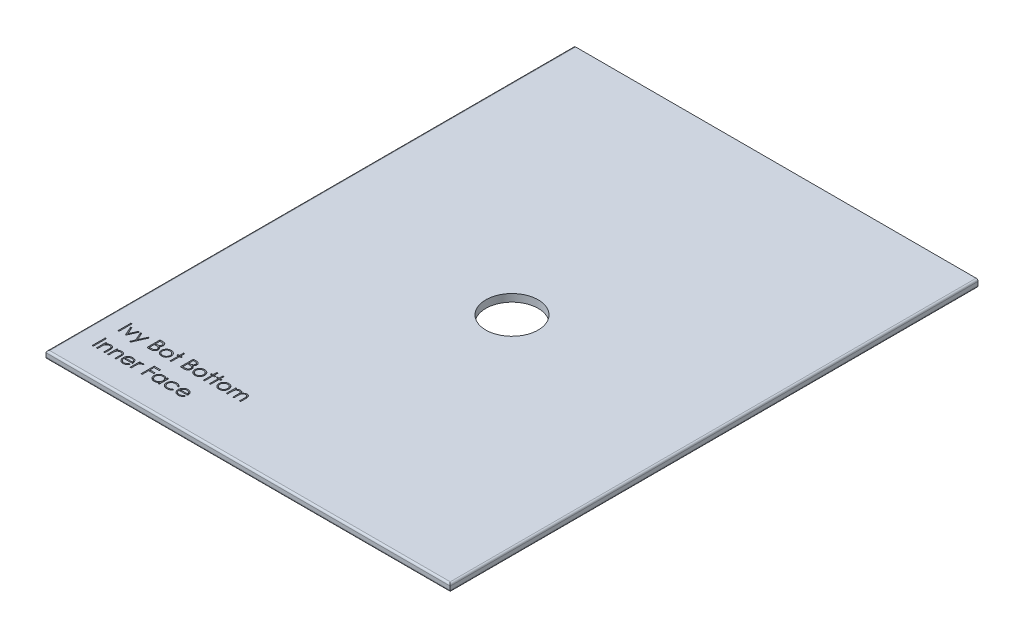
from build123d import *

# Parameters (mm, degrees)
SKETCH1_W           = 108
SKETCH1_H           = 141
BOSS_EXTRUDE1_DEPTH = 2
SKETCH6_R           = 7
CUT_EXTRUDE1_DEPTH  = 89.827079204
FILLET1_R           = 0.5
SKETCH9_W           = 0.314102564
SKETCH9_H           = 3.5
CUT_EXTRUDE4_DEPTH  = 1
CUT_EXTRUDE5_DEPTH  = 1


with BuildPart() as part:
    # Sketch1 → Boss-Extrude1 (new body)
    with BuildSketch(Plane(origin=(0, 0, 0), x_dir=(1, 0, 0), z_dir=(0, 1, 0))):
        Rectangle(SKETCH1_W, SKETCH1_H)
    extrude(amount=BOSS_EXTRUDE1_DEPTH)

    # Sketch6 → Cut-Extrude1 (cut, through all)
    with BuildSketch(Plane(origin=(0, 2, 0), x_dir=(1, 0, 0), z_dir=(0, 1, 0))):
        with Locations(Location((0, 0, 0), (0, 0, 270))):
            Circle(SKETCH6_R)
    extrude(amount=-CUT_EXTRUDE1_DEPTH, mode=Mode.SUBTRACT)

    # Fillet1
    fillet1_edges = [part.edges().sort_by_distance(p)[0] for p in [
        (54, 2, 0),
        (-54, 2, 0),
        (0, 0, -70.5),
        (54, 0, 0),
        (0, 0, 70.5),
        (-54, 0, 0),
        (0, 2, 70.5),
    ]]
    fillet(fillet1_edges, radius=FILLET1_R)

    # Sketch9 → Cut-Extrude4 (cut)
    # profile 1 of 21: a face of its own
    with BuildSketch(Plane(origin=(0, 2, 0), x_dir=(1, 0, 0), z_dir=(0, 1, 0))):
        with Locations((-48.84313938, -54.561589843)):
            Rectangle(SKETCH9_W, SKETCH9_H)
    # profile 2 of 21: a face of its own
    with BuildSketch(Plane(origin=(0, 2, 0), x_dir=(1, 0, 0), z_dir=(0, 1, 0))):
        Polygon((-48.147626559, -53.753897536), (-47.807582489, -53.753897536), (-46.958523995, -55.616077023), (-46.109465501, -53.753897536), (-45.769421431, -53.753897536), (-46.936088098, -56.311589843), (-46.980959892, -56.311589843), align=None)
    # profile 3 of 21: a face of its own
    with BuildSketch(Plane(origin=(0, 2, 0), x_dir=(1, 0, 0), z_dir=(0, 1, 0))):
        Polygon((-45.500190662, -53.753897536), (-45.161548835, -53.753897536), (-44.295663418, -55.712831831), (-43.416456687, -53.753897536), (-43.077113739, -53.753897536), (-44.647626559, -57.253897536), (-44.986969508, -57.253897536), (-44.466036014, -56.093540965), align=None)
    # profile 4 of 21: a face of its own
    with BuildSketch(Plane(origin=(0, 2, 0), x_dir=(1, 0, 0), z_dir=(0, 1, 0))):
        with BuildLine():
            Line((-41.237370149, -52.811589843), (-40.554477521, -52.811589843))
            add(Edge.make_bspline(
                [(-40.554477521, -52.811589843), (-40.521049042, -52.811765594), (-40.456256332, -52.812106242), (-40.36203689, -52.817389373), (-40.27378808, -52.824593043), (-40.191484307, -52.836023136), (-40.115163605, -52.849814913), (-40.044595968, -52.866516729), (-39.980005795, -52.886543342), (-39.902893059, -52.918389624), (-39.814972398, -52.965712792), (-39.719774005, -53.035641357), (-39.638369766, -53.12117382), (-39.568183449, -53.217656476), (-39.512382329, -53.323792247), (-39.472013032, -53.437051436), (-39.446455157, -53.555973178), (-39.443826722, -53.637616356), (-39.442498354, -53.678877504)],
                knots=[0, 0, 0, 0, 1.001505555, 1.941167018, 2.826882275, 3.653841531, 4.429895133, 5.150066043, 5.825578002, 6.45369114, 7.647487171, 8.808567382, 9.977351308, 11.170798116, 12.373658725, 13.556498008, 14.765093433, 16, 16, 16, 16], degree=3))
            add(Edge.make_bspline(
                [(-39.442498354, -53.678877504), (-39.443591572, -53.717530059), (-39.44573985, -53.793485976), (-39.466282609, -53.904580086), (-39.498443278, -54.010331304), (-39.543148527, -54.11035369), (-39.601250523, -54.202387303), (-39.670108842, -54.287174569), (-39.753185644, -54.361125626), (-39.815428884, -54.402468529), (-39.84704563, -54.42346885)],
                knots=[0, 0, 0, 0, 1.044552857, 2.05264487, 3.044412934, 4.028983338, 5.005914585, 5.980388656, 6.974128949, 8, 8, 8, 8], degree=3))
            add(Edge.make_bspline(
                [(-39.84704563, -54.42346885), (-39.807285202, -54.438733849), (-39.731213655, -54.467939573), (-39.626527642, -54.519575037), (-39.536332797, -54.575737148), (-39.459935651, -54.637068998), (-39.394597996, -54.703177808), (-39.337545055, -54.775032923), (-39.288863681, -54.853571681), (-39.247150757, -54.937975216), (-39.214602001, -55.027381684), (-39.190226097, -55.12095246), (-39.176258648, -55.218352016), (-39.174271006, -55.284637395), (-39.173267585, -55.31810026)],
                knots=[0, 0, 0, 0, 1.27268992, 2.434971085, 3.483601985, 4.442670788, 5.356604649, 6.2567628, 7.179492994, 8.113709626, 9.066344395, 10.018646069, 10.999752585, 12, 12, 12, 12], degree=3))
            add(Edge.make_bspline(
                [(-39.173267585, -55.31810026), (-39.174244431, -55.352267132), (-39.176166403, -55.41949141), (-39.190346375, -55.518246545), (-39.214355481, -55.612621491), (-39.247426628, -55.703226674), (-39.290588942, -55.789886809), (-39.343116907, -55.872700073), (-39.40574847, -55.950834403), (-39.475811339, -56.025158026), (-39.555073485, -56.091985814), (-39.64058924, -56.15150152), (-39.73343556, -56.200447582), (-39.832087554, -56.241563604), (-39.93765187, -56.272970802), (-40.049654477, -56.294943376), (-40.167998779, -56.309748413), (-40.24920853, -56.310965618), (-40.290855726, -56.311589843)],
                knots=[0, 0, 0, 0, 0.978564426, 1.925352924, 2.850884081, 3.763762016, 4.682927383, 5.618979971, 6.567305752, 7.547517671, 8.540179244, 9.531824382, 10.526200242, 11.540722885, 12.589160233, 13.674978461, 14.80764778, 16, 16, 16, 16], degree=3))
            Line((-40.290855726, -56.311589843), (-41.237370149, -56.311589843))
            Line((-41.237370149, -56.311589843), (-41.237370149, -52.811589843))
        make_face()
        with BuildLine():
            Line((-40.923267585, -53.170564202), (-40.923267585, -54.292359074))
            Line((-40.923267585, -54.292359074), (-40.712229925, -54.292359074))
            add(Edge.make_bspline(
                [(-40.712229925, -54.292359074), (-40.681381129, -54.291959151), (-40.62177497, -54.291186418), (-40.535455073, -54.288972901), (-40.455330055, -54.282774858), (-40.381538222, -54.276578596), (-40.314195778, -54.266504008), (-40.253451917, -54.254511885), (-40.19835332, -54.24182898), (-40.134813774, -54.220259493), (-40.062740826, -54.188381818), (-39.985907722, -54.138909982), (-39.918173252, -54.079985629), (-39.860976064, -54.011994667), (-39.814164594, -53.937128481), (-39.781650879, -53.856581601), (-39.759603594, -53.772361469), (-39.757612063, -53.714543216), (-39.756600918, -53.6851876)],
                knots=[0, 0, 0, 0, 1.156816544, 2.235205308, 3.236616184, 4.169592532, 5.011045266, 5.787822928, 6.49130361, 7.128639758, 8.301311294, 9.436451833, 10.541879658, 11.654887649, 12.756523258, 13.837046038, 14.901820046, 16, 16, 16, 16], degree=3))
            add(Edge.make_bspline(
                [(-39.756600918, -53.6851876), (-39.757127098, -53.665761828), (-39.758159258, -53.627656056), (-39.766612561, -53.572106702), (-39.780980135, -53.51986295), (-39.799434428, -53.470208839), (-39.825223117, -53.424696989), (-39.85558658, -53.381753793), (-39.892272271, -53.342841675), (-39.934029583, -53.306472176), (-39.982038206, -53.274227649), (-40.036269498, -53.245986886), (-40.097457175, -53.223246109), (-40.16457003, -53.203329956), (-40.238641118, -53.189341663), (-40.318815671, -53.177688275), (-40.40575039, -53.171755533), (-40.465895493, -53.17097017), (-40.496985533, -53.170564202)],
                knots=[0, 0, 0, 0, 0.91205012, 1.789085906, 2.630437955, 3.453916878, 4.269457761, 5.079663411, 5.91843418, 6.774407191, 7.675494373, 8.627863946, 9.638891023, 10.736472738, 11.911756761, 13.175263542, 14.539845004, 16, 16, 16, 16], degree=3))
            Line((-40.496985533, -53.170564202), (-40.923267585, -53.170564202))
        make_face(mode=Mode.SUBTRACT)
        with BuildLine():
            Line((-40.923267585, -54.651333433), (-40.923267585, -55.952615484))
            Line((-40.923267585, -55.952615484), (-40.47595188, -55.952615484))
            add(Edge.make_bspline(
                [(-40.47595188, -55.952615484), (-40.443932954, -55.952231737), (-40.382220695, -55.951492115), (-40.293119465, -55.94907756), (-40.210536361, -55.943585284), (-40.134848226, -55.934939435), (-40.065237773, -55.925560985), (-40.00254007, -55.912949705), (-39.946246876, -55.898500744), (-39.880972569, -55.876166572), (-39.80746906, -55.841470101), (-39.728258204, -55.789155874), (-39.657831986, -55.726832567), (-39.598026727, -55.654701652), (-39.549013738, -55.576270326), (-39.513358283, -55.493124976), (-39.491367426, -55.406639448), (-39.488705257, -55.347672736), (-39.487370149, -55.31810026)],
                knots=[0, 0, 0, 0, 1.160039823, 2.235823828, 3.228722157, 4.157150951, 4.99529583, 5.772374946, 6.472645482, 7.099169577, 8.269452708, 9.405989375, 10.527446681, 11.663510218, 12.788923519, 13.866172445, 14.929861265, 16, 16, 16, 16], degree=3))
            add(Edge.make_bspline(
                [(-39.487370149, -55.31810026), (-39.487646253, -55.29960692), (-39.488194008, -55.262918538), (-39.496454623, -55.209002719), (-39.508468493, -55.156776845), (-39.523999927, -55.106099105), (-39.546619394, -55.057885728), (-39.573025939, -55.011183169), (-39.603987341, -54.965929689), (-39.652231507, -54.908717436), (-39.722403491, -54.842800423), (-39.822110266, -54.778262921), (-39.935482564, -54.726215114), (-40.017710057, -54.704115637), (-40.060186655, -54.692699619)],
                knots=[0, 0, 0, 0, 0.723448775, 1.435228256, 2.130040452, 2.821711965, 3.505591119, 4.210454504, 4.921174351, 5.648778258, 7.137944449, 8.670945889, 10.280296675, 12, 12, 12, 12], degree=3))
            add(Edge.make_bspline(
                [(-40.060186655, -54.692699619), (-40.077215751, -54.689244535), (-40.114138343, -54.6817532), (-40.174345924, -54.673845497), (-40.243081793, -54.666800437), (-40.32050467, -54.661589279), (-40.406712511, -54.656202736), (-40.50188943, -54.654107915), (-40.605646745, -54.651608655), (-40.677639117, -54.65142752), (-40.715034412, -54.651333433)],
                knots=[0, 0, 0, 0, 0.634451884, 1.375622551, 2.216452059, 3.157844607, 4.20941857, 5.370758133, 6.634282058, 8, 8, 8, 8], degree=3))
            Line((-40.715034412, -54.651333433), (-40.923267585, -54.651333433))
        make_face(mode=Mode.SUBTRACT)
    # profile 5 of 21: a face of its own
    with BuildSketch(Plane(origin=(0, 2, 0), x_dir=(1, 0, 0), z_dir=(0, 1, 0))):
        with BuildLine():
            add(Edge.make_bspline(
                [(-37.309685854, -53.709025741), (-37.261694581, -53.710047632), (-37.167595424, -53.712051311), (-37.029787538, -53.733466276), (-36.898242402, -53.766213641), (-36.77245621, -53.811485203), (-36.654039914, -53.872167153), (-36.54126867, -53.944576445), (-36.434451661, -54.030359038), (-36.370428632, -54.096717106), (-36.337931046, -54.13039994)],
                knots=[0, 0, 0, 0, 1.054011418, 2.066658804, 3.057071809, 4.030435133, 4.997543892, 5.974964718, 6.972108034, 8, 8, 8, 8], degree=3))
            add(Edge.make_bspline(
                [(-36.337931046, -54.13039994), (-36.309949092, -54.162613925), (-36.254526712, -54.226418468), (-36.183460993, -54.329874081), (-36.122239433, -54.437014181), (-36.073176472, -54.549261508), (-36.034491448, -54.665636179), (-36.007025752, -54.78653819), (-35.990688817, -54.911700537), (-35.98848585, -54.996704375), (-35.987370149, -55.039754908)],
                knots=[0, 0, 0, 0, 1.025258237, 2.030674902, 3.01204498, 3.988269485, 4.97094183, 5.956517959, 6.965070386, 8, 8, 8, 8], degree=3))
            add(Edge.make_bspline(
                [(-35.987370149, -55.039754908), (-35.988351486, -55.083054965), (-35.990290654, -55.168617899), (-36.008634271, -55.294637264), (-36.037165357, -55.416832087), (-36.077997195, -55.534690781), (-36.130355304, -55.648573608), (-36.194245992, -55.757983157), (-36.270117609, -55.863135291), (-36.356121606, -55.963137129), (-36.451173482, -56.055303344), (-36.55428963, -56.135631613), (-36.663443664, -56.204453138), (-36.780087017, -56.259889553), (-36.903154504, -56.303599254), (-37.032911572, -56.33429927), (-37.169156642, -56.352860954), (-37.262183864, -56.355244527), (-37.309685854, -56.356461638)],
                knots=[0, 0, 0, 0, 0.998656419, 1.973391657, 2.932242238, 3.890759089, 4.846373663, 5.82037756, 6.809684879, 7.83454468, 8.860553229, 9.859544525, 10.845671541, 11.83227036, 12.833544569, 13.85385346, 14.904124723, 16, 16, 16, 16], degree=3))
            add(Edge.make_bspline(
                [(-37.309685854, -56.356461638), (-37.357420574, -56.355240442), (-37.450911433, -56.352848668), (-37.587637415, -56.334371385), (-37.717627034, -56.303613402), (-37.840855633, -56.25974591), (-37.95800048, -56.204451366), (-38.067786977, -56.135839676), (-38.170986892, -56.055279521), (-38.266058876, -55.963143584), (-38.352057482, -55.863133628), (-38.42793049, -55.757983589), (-38.491820816, -55.648573496), (-38.54417902, -55.534690811), (-38.585010833, -55.416832079), (-38.613541926, -55.294637266), (-38.63188554, -55.168617898), (-38.633824709, -55.083054965), (-38.634806046, -55.039754908)],
                knots=[0, 0, 0, 0, 1.099876186, 2.154163076, 3.173186993, 4.173200201, 5.163417411, 6.152872554, 7.150605724, 8.17532212, 9.198891216, 10.186952605, 11.159729845, 12.11414092, 13.071450619, 14.029093627, 15.002601286, 16, 16, 16, 16], degree=3))
            add(Edge.make_bspline(
                [(-38.634806046, -55.039754908), (-38.633682736, -54.996938362), (-38.631458775, -54.912168959), (-38.615138265, -54.787241899), (-38.587779709, -54.66654451), (-38.549048312, -54.550619034), (-38.499533122, -54.438863597), (-38.439171834, -54.331458766), (-38.367381201, -54.228470966), (-38.31217925, -54.164748886), (-38.284245149, -54.132503305)],
                knots=[0, 0, 0, 0, 1.031353054, 2.041901799, 3.029428768, 4.008703097, 4.981709435, 5.96992636, 6.972712378, 8, 8, 8, 8], degree=3))
            add(Edge.make_bspline(
                [(-38.284245149, -54.132503305), (-38.251796558, -54.098528366), (-38.187980694, -54.031710669), (-38.080631966, -53.946178145), (-37.968138145, -53.872262072), (-37.848413219, -53.812785856), (-37.722730361, -53.765947338), (-37.590511119, -53.733381823), (-37.452235603, -53.712128468), (-37.357675982, -53.71007029), (-37.309685854, -53.709025741)],
                knots=[0, 0, 0, 0, 1.027980169, 2.021703884, 2.998553061, 3.971491411, 4.943284454, 5.930300938, 6.949603206, 8, 8, 8, 8], degree=3))
        make_face()
        with BuildLine():
            add(Edge.make_bspline(
                [(-37.311088098, -54.023128305), (-37.345025709, -54.024092897), (-37.412024838, -54.025997179), (-37.510644422, -54.040481084), (-37.605584576, -54.063428588), (-37.69702542, -54.096032644), (-37.784658593, -54.138131543), (-37.868567995, -54.189839903), (-37.949000435, -54.25047286), (-38.024382498, -54.319935531), (-38.093564811, -54.395814526), (-38.154042787, -54.476662885), (-38.205467894, -54.561169231), (-38.248308053, -54.649421442), (-38.280215241, -54.742313856), (-38.303388263, -54.838794487), (-38.317858504, -54.939059904), (-38.319744882, -55.007220922), (-38.320703482, -55.041858273)],
                knots=[0, 0, 0, 0, 1.021534396, 2.016698045, 2.994645724, 3.958388632, 4.93408049, 5.916473867, 6.921342795, 7.962252576, 8.998418191, 10.008913653, 10.997312074, 11.973003931, 12.956656626, 13.948281152, 14.957379055, 16, 16, 16, 16], degree=3))
            add(Edge.make_bspline(
                [(-38.320703482, -55.041858273), (-38.319096659, -55.0866103), (-38.315907414, -55.175434706), (-38.289972178, -55.306245828), (-38.246585898, -55.43182768), (-38.187998618, -55.551444066), (-38.114592399, -55.662116344), (-38.028105333, -55.760787829), (-37.929465632, -55.84597364), (-37.819849132, -55.916654486), (-37.701494814, -55.972814241), (-37.576238493, -56.012613217), (-37.445597799, -56.03848491), (-37.356317068, -56.041056384), (-37.311088098, -56.042359074)],
                knots=[0, 0, 0, 0, 1.016792936, 2.018143844, 3.017858371, 4.030088057, 5.03801393, 6.028138512, 7.003788237, 7.991172063, 8.984598303, 9.972568034, 10.972917682, 12, 12, 12, 12], degree=3))
            add(Edge.make_bspline(
                [(-37.311088098, -56.042359074), (-37.265861729, -56.041048794), (-37.176586133, -56.038462337), (-37.046126956, -56.012743517), (-36.921212984, -55.972639857), (-36.802981596, -55.916717647), (-36.693414993, -55.845705232), (-36.594065872, -55.761268855), (-36.508317261, -55.661855004), (-36.434983656, -55.551297475), (-36.375436913, -55.432013123), (-36.332253711, -55.30622265), (-36.306256125, -55.175440608), (-36.303075297, -55.086612278), (-36.301472713, -55.041858273)],
                knots=[0, 0, 0, 0, 1.02726834, 2.027799167, 3.010890988, 4.004497153, 4.992059811, 5.971914811, 6.958719428, 7.966827853, 8.981595046, 9.981490638, 10.983022906, 12, 12, 12, 12], degree=3))
            add(Edge.make_bspline(
                [(-36.301472713, -55.041858273), (-36.302430983, -55.007220715), (-36.304316712, -54.93905929), (-36.318791676, -54.838796836), (-36.341947216, -54.742305239), (-36.373918833, -54.649453236), (-36.416572847, -54.560940732), (-36.46898964, -54.476911005), (-36.529220666, -54.395534459), (-36.599237787, -54.320180818), (-36.674541165, -54.250445781), (-36.755006203, -54.189816392), (-36.838791181, -54.138358796), (-36.926169764, -54.095672556), (-37.017622332, -54.063725215), (-37.112429461, -54.040348584), (-37.210628271, -54.026058387), (-37.277387314, -54.024111246), (-37.311088098, -54.023128305)],
                knots=[0, 0, 0, 0, 1.042956736, 2.052379634, 3.044323526, 4.02829302, 5.004299113, 5.996692471, 7.007513377, 8.048758398, 9.090003419, 10.095195979, 11.07790575, 12.047570684, 13.018257071, 13.989683339, 14.985167495, 16, 16, 16, 16], degree=3))
        make_face(mode=Mode.SUBTRACT)
    # profile 6 of 21: a face of its own
    with BuildSketch(Plane(origin=(0, 2, 0), x_dir=(1, 0, 0), z_dir=(0, 1, 0))):
        Polygon((-35.045062457, -52.721846254), (-34.730959892, -52.721846254), (-34.730959892, -53.753897536), (-34.282241944, -53.753897536), (-34.282241944, -54.0680001), (-34.730959892, -54.0680001), (-34.730959892, -56.311589843), (-35.045062457, -56.311589843), (-35.045062457, -54.0680001), (-35.493780405, -54.0680001), (-35.493780405, -53.753897536), (-35.045062457, -53.753897536), align=None)
    # profile 7 of 21: a face of its own
    with BuildSketch(Plane(origin=(0, 2, 0), x_dir=(1, 0, 0), z_dir=(0, 1, 0))):
        with BuildLine():
            Line((-32.307882969, -52.811589843), (-31.624990341, -52.811589843))
            add(Edge.make_bspline(
                [(-31.624990341, -52.811589843), (-31.591561863, -52.811765594), (-31.526769153, -52.812106242), (-31.432549711, -52.817389373), (-31.3443009, -52.824593043), (-31.261997128, -52.836023136), (-31.185676425, -52.849814913), (-31.115108788, -52.866516729), (-31.050518616, -52.886543342), (-30.97340588, -52.918389624), (-30.885485219, -52.965712792), (-30.790286826, -53.035641357), (-30.708882587, -53.12117382), (-30.638696269, -53.217656476), (-30.58289515, -53.323792247), (-30.542525852, -53.437051436), (-30.516967977, -53.555973178), (-30.514339543, -53.637616356), (-30.513011175, -53.678877504)],
                knots=[0, 0, 0, 0, 1.001505555, 1.941167018, 2.826882275, 3.653841531, 4.429895133, 5.150066043, 5.825578002, 6.45369114, 7.647487171, 8.808567382, 9.977351308, 11.170798116, 12.373658725, 13.556498008, 14.765093433, 16, 16, 16, 16], degree=3))
            add(Edge.make_bspline(
                [(-30.513011175, -53.678877504), (-30.514104393, -53.717530059), (-30.51625267, -53.793485976), (-30.53679543, -53.904580086), (-30.568956098, -54.010331304), (-30.613661347, -54.11035369), (-30.671763343, -54.202387303), (-30.740621662, -54.287174569), (-30.823698465, -54.361125626), (-30.885941705, -54.402468529), (-30.91755845, -54.42346885)],
                knots=[0, 0, 0, 0, 1.044552857, 2.05264487, 3.044412934, 4.028983338, 5.005914585, 5.980388656, 6.974128949, 8, 8, 8, 8], degree=3))
            add(Edge.make_bspline(
                [(-30.91755845, -54.42346885), (-30.877798023, -54.438733849), (-30.801726475, -54.467939573), (-30.697040463, -54.519575037), (-30.606845618, -54.575737148), (-30.530448472, -54.637068998), (-30.465110817, -54.703177808), (-30.408057875, -54.775032923), (-30.359376501, -54.853571681), (-30.317663578, -54.937975216), (-30.285114822, -55.027381684), (-30.260738917, -55.12095246), (-30.246771468, -55.218352016), (-30.244783827, -55.284637395), (-30.243780405, -55.31810026)],
                knots=[0, 0, 0, 0, 1.27268992, 2.434971085, 3.483601985, 4.442670788, 5.356604649, 6.2567628, 7.179492994, 8.113709626, 9.066344395, 10.018646069, 10.999752585, 12, 12, 12, 12], degree=3))
            add(Edge.make_bspline(
                [(-30.243780405, -55.31810026), (-30.244757251, -55.352267132), (-30.246679223, -55.41949141), (-30.260859195, -55.518246545), (-30.284868302, -55.612621491), (-30.317939448, -55.703226674), (-30.361101763, -55.789886809), (-30.413629727, -55.872700073), (-30.476261291, -55.950834403), (-30.54632416, -56.025158026), (-30.625586305, -56.091985814), (-30.71110206, -56.15150152), (-30.80394838, -56.200447582), (-30.902600374, -56.241563604), (-31.00816469, -56.272970802), (-31.120167298, -56.294943376), (-31.2385116, -56.309748413), (-31.319721351, -56.310965618), (-31.361368546, -56.311589843)],
                knots=[0, 0, 0, 0, 0.978564426, 1.925352924, 2.850884081, 3.763762016, 4.682927383, 5.618979971, 6.567305752, 7.547517671, 8.540179244, 9.531824382, 10.526200242, 11.540722885, 12.589160233, 13.674978461, 14.80764778, 16, 16, 16, 16], degree=3))
            Line((-31.361368546, -56.311589843), (-32.307882969, -56.311589843))
            Line((-32.307882969, -56.311589843), (-32.307882969, -52.811589843))
        make_face()
        with BuildLine():
            Line((-31.993780405, -53.170564202), (-31.993780405, -54.292359074))
            Line((-31.993780405, -54.292359074), (-31.782742745, -54.292359074))
            add(Edge.make_bspline(
                [(-31.782742745, -54.292359074), (-31.75189395, -54.291959151), (-31.69228779, -54.291186418), (-31.605967894, -54.288972901), (-31.525842876, -54.282774858), (-31.452051043, -54.276578596), (-31.384708599, -54.266504008), (-31.323964737, -54.254511885), (-31.26886614, -54.24182898), (-31.205326595, -54.220259493), (-31.133253646, -54.188381818), (-31.056420542, -54.138909982), (-30.988686072, -54.079985629), (-30.931488885, -54.011994667), (-30.884677414, -53.937128481), (-30.852163699, -53.856581601), (-30.830116415, -53.772361469), (-30.828124883, -53.714543216), (-30.827113739, -53.6851876)],
                knots=[0, 0, 0, 0, 1.156816544, 2.235205308, 3.236616184, 4.169592532, 5.011045266, 5.787822928, 6.49130361, 7.128639758, 8.301311294, 9.436451833, 10.541879658, 11.654887649, 12.756523258, 13.837046038, 14.901820046, 16, 16, 16, 16], degree=3))
            add(Edge.make_bspline(
                [(-30.827113739, -53.6851876), (-30.827639919, -53.665761828), (-30.828672079, -53.627656056), (-30.837125381, -53.572106702), (-30.851492956, -53.51986295), (-30.869947249, -53.470208839), (-30.895735938, -53.424696989), (-30.926099401, -53.381753793), (-30.962785091, -53.342841675), (-31.004542404, -53.306472176), (-31.052551027, -53.274227649), (-31.106782319, -53.245986886), (-31.167969996, -53.223246109), (-31.235082851, -53.203329956), (-31.309153938, -53.189341663), (-31.389328492, -53.177688275), (-31.476263211, -53.171755533), (-31.536408313, -53.17097017), (-31.567498354, -53.170564202)],
                knots=[0, 0, 0, 0, 0.91205012, 1.789085906, 2.630437955, 3.453916878, 4.269457761, 5.079663411, 5.91843418, 6.774407191, 7.675494373, 8.627863946, 9.638891023, 10.736472738, 11.911756761, 13.175263542, 14.539845004, 16, 16, 16, 16], degree=3))
            Line((-31.567498354, -53.170564202), (-31.993780405, -53.170564202))
        make_face(mode=Mode.SUBTRACT)
        with BuildLine():
            Line((-31.993780405, -54.651333433), (-31.993780405, -55.952615484))
            Line((-31.993780405, -55.952615484), (-31.5464647, -55.952615484))
            add(Edge.make_bspline(
                [(-31.5464647, -55.952615484), (-31.514445774, -55.952231737), (-31.452733516, -55.951492115), (-31.363632286, -55.94907756), (-31.281049182, -55.943585284), (-31.205361046, -55.934939435), (-31.135750593, -55.925560985), (-31.07305289, -55.912949705), (-31.016759697, -55.898500744), (-30.951485389, -55.876166572), (-30.877981881, -55.841470101), (-30.798771024, -55.789155874), (-30.728344806, -55.726832567), (-30.668539547, -55.654701652), (-30.619526559, -55.576270326), (-30.583871104, -55.493124976), (-30.561880247, -55.406639448), (-30.559218077, -55.347672736), (-30.557882969, -55.31810026)],
                knots=[0, 0, 0, 0, 1.160039823, 2.235823828, 3.228722157, 4.157150951, 4.99529583, 5.772374946, 6.472645482, 7.099169577, 8.269452708, 9.405989375, 10.527446681, 11.663510218, 12.788923519, 13.866172445, 14.929861265, 16, 16, 16, 16], degree=3))
            add(Edge.make_bspline(
                [(-30.557882969, -55.31810026), (-30.558159074, -55.29960692), (-30.558706829, -55.262918538), (-30.566967444, -55.209002719), (-30.578981314, -55.156776845), (-30.594512747, -55.106099105), (-30.617132215, -55.057885728), (-30.64353876, -55.011183169), (-30.674500161, -54.965929689), (-30.722744327, -54.908717436), (-30.792916312, -54.842800423), (-30.892623087, -54.778262921), (-31.005995385, -54.726215114), (-31.088222878, -54.704115637), (-31.130699476, -54.692699619)],
                knots=[0, 0, 0, 0, 0.723448775, 1.435228256, 2.130040452, 2.821711965, 3.505591119, 4.210454504, 4.921174351, 5.648778258, 7.137944449, 8.670945889, 10.280296675, 12, 12, 12, 12], degree=3))
            add(Edge.make_bspline(
                [(-31.130699476, -54.692699619), (-31.147728572, -54.689244535), (-31.184651164, -54.6817532), (-31.244858744, -54.673845497), (-31.313594613, -54.666800437), (-31.391017491, -54.661589279), (-31.477225332, -54.656202736), (-31.57240225, -54.654107915), (-31.676159565, -54.651608655), (-31.748151937, -54.65142752), (-31.785547232, -54.651333433)],
                knots=[0, 0, 0, 0, 0.634451884, 1.375622551, 2.216452059, 3.157844607, 4.20941857, 5.370758133, 6.634282058, 8, 8, 8, 8], degree=3))
            Line((-31.785547232, -54.651333433), (-31.993780405, -54.651333433))
        make_face(mode=Mode.SUBTRACT)
    # profile 8 of 21: a face of its own
    with BuildSketch(Plane(origin=(0, 2, 0), x_dir=(1, 0, 0), z_dir=(0, 1, 0))):
        with BuildLine():
            add(Edge.make_bspline(
                [(-28.380198675, -53.709025741), (-28.332207402, -53.710047632), (-28.238108244, -53.712051311), (-28.100300358, -53.733466276), (-27.968755222, -53.766213641), (-27.84296903, -53.811485203), (-27.724552735, -53.872167153), (-27.611781491, -53.944576445), (-27.504964482, -54.030359038), (-27.440941452, -54.096717106), (-27.408443867, -54.13039994)],
                knots=[0, 0, 0, 0, 1.054011418, 2.066658804, 3.057071809, 4.030435133, 4.997543892, 5.974964718, 6.972108034, 8, 8, 8, 8], degree=3))
            add(Edge.make_bspline(
                [(-27.408443867, -54.13039994), (-27.380461913, -54.162613925), (-27.325039533, -54.226418468), (-27.253973814, -54.329874081), (-27.192752254, -54.437014181), (-27.143689293, -54.549261508), (-27.105004269, -54.665636179), (-27.077538573, -54.78653819), (-27.061201638, -54.911700537), (-27.058998671, -54.996704375), (-27.057882969, -55.039754908)],
                knots=[0, 0, 0, 0, 1.025258237, 2.030674902, 3.01204498, 3.988269485, 4.97094183, 5.956517959, 6.965070386, 8, 8, 8, 8], degree=3))
            add(Edge.make_bspline(
                [(-27.057882969, -55.039754908), (-27.058864307, -55.083054965), (-27.060803475, -55.168617899), (-27.079147091, -55.294637264), (-27.107678177, -55.416832087), (-27.148510015, -55.534690781), (-27.200868125, -55.648573608), (-27.264758812, -55.757983157), (-27.340630429, -55.863135291), (-27.426634426, -55.963137129), (-27.521686302, -56.055303344), (-27.624802451, -56.135631613), (-27.733956484, -56.204453138), (-27.850599838, -56.259889553), (-27.973667324, -56.303599254), (-28.103424393, -56.33429927), (-28.239669463, -56.352860954), (-28.332696684, -56.355244527), (-28.380198675, -56.356461638)],
                knots=[0, 0, 0, 0, 0.998656419, 1.973391657, 2.932242238, 3.890759089, 4.846373663, 5.82037756, 6.809684879, 7.83454468, 8.860553229, 9.859544525, 10.845671541, 11.83227036, 12.833544569, 13.85385346, 14.904124723, 16, 16, 16, 16], degree=3))
            add(Edge.make_bspline(
                [(-28.380198675, -56.356461638), (-28.427933394, -56.355240442), (-28.521424254, -56.352848668), (-28.658150236, -56.334371385), (-28.788139855, -56.303613402), (-28.911368453, -56.25974591), (-29.0285133, -56.204451366), (-29.138299797, -56.135839676), (-29.241499713, -56.055279521), (-29.336571697, -55.963143584), (-29.422570302, -55.863133628), (-29.498443311, -55.757983589), (-29.562333637, -55.648573496), (-29.614691841, -55.534690811), (-29.655523654, -55.416832079), (-29.684054746, -55.294637266), (-29.702398361, -55.168617898), (-29.704337529, -55.083054965), (-29.705318867, -55.039754908)],
                knots=[0, 0, 0, 0, 1.099876186, 2.154163076, 3.173186993, 4.173200201, 5.163417411, 6.152872554, 7.150605724, 8.17532212, 9.198891216, 10.186952605, 11.159729845, 12.11414092, 13.071450619, 14.029093627, 15.002601286, 16, 16, 16, 16], degree=3))
            add(Edge.make_bspline(
                [(-29.705318867, -55.039754908), (-29.704195556, -54.996938362), (-29.701971595, -54.912168959), (-29.685651086, -54.787241899), (-29.658292529, -54.66654451), (-29.619561133, -54.550619034), (-29.570045942, -54.438863597), (-29.509684654, -54.331458766), (-29.437894022, -54.228470966), (-29.38269207, -54.164748886), (-29.354757969, -54.132503305)],
                knots=[0, 0, 0, 0, 1.031353054, 2.041901799, 3.029428768, 4.008703097, 4.981709435, 5.96992636, 6.972712378, 8, 8, 8, 8], degree=3))
            add(Edge.make_bspline(
                [(-29.354757969, -54.132503305), (-29.322309378, -54.098528366), (-29.258493515, -54.031710669), (-29.151144787, -53.946178145), (-29.038650966, -53.872262072), (-28.91892604, -53.812785856), (-28.793243182, -53.765947338), (-28.661023939, -53.733381823), (-28.522748424, -53.712128468), (-28.428188802, -53.71007029), (-28.380198675, -53.709025741)],
                knots=[0, 0, 0, 0, 1.027980169, 2.021703884, 2.998553061, 3.971491411, 4.943284454, 5.930300938, 6.949603206, 8, 8, 8, 8], degree=3))
        make_face()
        with BuildLine():
            add(Edge.make_bspline(
                [(-28.381600918, -54.023128305), (-28.415538529, -54.024092897), (-28.482537658, -54.025997179), (-28.581157243, -54.040481084), (-28.676097397, -54.063428588), (-28.767538241, -54.096032644), (-28.855171413, -54.138131543), (-28.939080816, -54.189839903), (-29.019513256, -54.25047286), (-29.094895319, -54.319935531), (-29.164077631, -54.395814526), (-29.224555608, -54.476662885), (-29.275980714, -54.561169231), (-29.318820873, -54.649421442), (-29.350728061, -54.742313856), (-29.373901084, -54.838794487), (-29.388371324, -54.939059904), (-29.390257703, -55.007220922), (-29.391216303, -55.041858273)],
                knots=[0, 0, 0, 0, 1.021534396, 2.016698045, 2.994645724, 3.958388632, 4.93408049, 5.916473867, 6.921342795, 7.962252576, 8.998418191, 10.008913653, 10.997312074, 11.973003931, 12.956656626, 13.948281152, 14.957379055, 16, 16, 16, 16], degree=3))
            add(Edge.make_bspline(
                [(-29.391216303, -55.041858273), (-29.389609479, -55.0866103), (-29.386420235, -55.175434706), (-29.360484998, -55.306245828), (-29.317098718, -55.43182768), (-29.258511439, -55.551444066), (-29.18510522, -55.662116344), (-29.098618153, -55.760787829), (-28.999978453, -55.84597364), (-28.890361953, -55.916654486), (-28.772007635, -55.972814241), (-28.646751314, -56.012613217), (-28.51611062, -56.03848491), (-28.426829888, -56.041056384), (-28.381600918, -56.042359074)],
                knots=[0, 0, 0, 0, 1.016792936, 2.018143844, 3.017858371, 4.030088057, 5.03801393, 6.028138512, 7.003788237, 7.991172063, 8.984598303, 9.972568034, 10.972917682, 12, 12, 12, 12], degree=3))
            add(Edge.make_bspline(
                [(-28.381600918, -56.042359074), (-28.336374549, -56.041048794), (-28.247098953, -56.038462337), (-28.116639776, -56.012743517), (-27.991725804, -55.972639857), (-27.873494417, -55.916717647), (-27.763927814, -55.845705232), (-27.664578692, -55.761268855), (-27.578830081, -55.661855004), (-27.505496476, -55.551297475), (-27.445949733, -55.432013123), (-27.402766532, -55.30622265), (-27.376768946, -55.175440608), (-27.373588117, -55.086612278), (-27.371985533, -55.041858273)],
                knots=[0, 0, 0, 0, 1.02726834, 2.027799167, 3.010890988, 4.004497153, 4.992059811, 5.971914811, 6.958719428, 7.966827853, 8.981595046, 9.981490638, 10.983022906, 12, 12, 12, 12], degree=3))
            add(Edge.make_bspline(
                [(-27.371985533, -55.041858273), (-27.372943804, -55.007220715), (-27.374829533, -54.93905929), (-27.389304497, -54.838796836), (-27.412460037, -54.742305239), (-27.444431654, -54.649453236), (-27.487085668, -54.560940732), (-27.539502461, -54.476911005), (-27.599733486, -54.395534459), (-27.669750607, -54.320180818), (-27.745053985, -54.250445781), (-27.825519023, -54.189816392), (-27.909304002, -54.138358796), (-27.996682584, -54.095672556), (-28.088135152, -54.063725215), (-28.182942281, -54.040348584), (-28.281141091, -54.026058387), (-28.347900134, -54.024111246), (-28.381600918, -54.023128305)],
                knots=[0, 0, 0, 0, 1.042956736, 2.052379634, 3.044323526, 4.02829302, 5.004299113, 5.996692471, 7.007513377, 8.048758398, 9.090003419, 10.095195979, 11.07790575, 12.047570684, 13.018257071, 13.989683339, 14.985167495, 16, 16, 16, 16], degree=3))
        make_face(mode=Mode.SUBTRACT)
    # profile 9 of 21: a face of its own
    with BuildSketch(Plane(origin=(0, 2, 0), x_dir=(1, 0, 0), z_dir=(0, 1, 0))):
        Polygon((-26.115575277, -52.721846254), (-25.801472713, -52.721846254), (-25.801472713, -53.753897536), (-25.352754764, -53.753897536), (-25.352754764, -54.0680001), (-25.801472713, -54.0680001), (-25.801472713, -56.311589843), (-26.115575277, -56.311589843), (-26.115575277, -54.0680001), (-26.564293226, -54.0680001), (-26.564293226, -53.753897536), (-26.115575277, -53.753897536), align=None)
    # profile 10 of 21: a face of its own
    with BuildSketch(Plane(origin=(0, 2, 0), x_dir=(1, 0, 0), z_dir=(0, 1, 0))):
        Polygon((-24.500190662, -52.721846254), (-24.186088098, -52.721846254), (-24.186088098, -53.753897536), (-23.737370149, -53.753897536), (-23.737370149, -54.0680001), (-24.186088098, -54.0680001), (-24.186088098, -56.311589843), (-24.500190662, -56.311589843), (-24.500190662, -54.0680001), (-24.94890861, -54.0680001), (-24.94890861, -53.753897536), (-24.500190662, -53.753897536), align=None)
    # profile 11 of 21: a face of its own
    with BuildSketch(Plane(origin=(0, 2, 0), x_dir=(1, 0, 0), z_dir=(0, 1, 0))):
        with BuildLine():
            add(Edge.make_bspline(
                [(-21.963532008, -53.709025741), (-21.915540735, -53.710047632), (-21.821441577, -53.712051311), (-21.683633692, -53.733466276), (-21.552088556, -53.766213641), (-21.426302363, -53.811485203), (-21.307886068, -53.872167153), (-21.195114824, -53.944576445), (-21.088297815, -54.030359038), (-21.024274786, -54.096717106), (-20.9917772, -54.13039994)],
                knots=[0, 0, 0, 0, 1.054011418, 2.066658804, 3.057071809, 4.030435133, 4.997543892, 5.974964718, 6.972108034, 8, 8, 8, 8], degree=3))
            add(Edge.make_bspline(
                [(-20.9917772, -54.13039994), (-20.963795246, -54.162613925), (-20.908372866, -54.226418468), (-20.837307147, -54.329874081), (-20.776085587, -54.437014181), (-20.727022626, -54.549261508), (-20.688337602, -54.665636179), (-20.660871906, -54.78653819), (-20.644534971, -54.911700537), (-20.642332004, -54.996704375), (-20.641216303, -55.039754908)],
                knots=[0, 0, 0, 0, 1.025258237, 2.030674902, 3.01204498, 3.988269485, 4.97094183, 5.956517959, 6.965070386, 8, 8, 8, 8], degree=3))
            add(Edge.make_bspline(
                [(-20.641216303, -55.039754908), (-20.64219764, -55.083054965), (-20.644136808, -55.168617899), (-20.662480425, -55.294637264), (-20.691011511, -55.416832087), (-20.731843349, -55.534690781), (-20.784201458, -55.648573608), (-20.848092146, -55.757983157), (-20.923963763, -55.863135291), (-21.009967759, -55.963137129), (-21.105019636, -56.055303344), (-21.208135784, -56.135631613), (-21.317289818, -56.204453138), (-21.433933171, -56.259889553), (-21.557000658, -56.303599254), (-21.686757726, -56.33429927), (-21.823002796, -56.352860954), (-21.916030018, -56.355244527), (-21.963532008, -56.356461638)],
                knots=[0, 0, 0, 0, 0.998656419, 1.973391657, 2.932242238, 3.890759089, 4.846373663, 5.82037756, 6.809684879, 7.83454468, 8.860553229, 9.859544525, 10.845671541, 11.83227036, 12.833544569, 13.85385346, 14.904124723, 16, 16, 16, 16], degree=3))
            add(Edge.make_bspline(
                [(-21.963532008, -56.356461638), (-22.011266727, -56.355240442), (-22.104757587, -56.352848668), (-22.241483569, -56.334371385), (-22.371473188, -56.303613402), (-22.494701786, -56.25974591), (-22.611846633, -56.204451366), (-22.72163313, -56.135839676), (-22.824833046, -56.055279521), (-22.91990503, -55.963143584), (-23.005903636, -55.863133628), (-23.081776644, -55.757983589), (-23.14566697, -55.648573496), (-23.198025174, -55.534690811), (-23.238856987, -55.416832079), (-23.26738808, -55.294637266), (-23.285731694, -55.168617898), (-23.287670863, -55.083054965), (-23.2886522, -55.039754908)],
                knots=[0, 0, 0, 0, 1.099876186, 2.154163076, 3.173186993, 4.173200201, 5.163417411, 6.152872554, 7.150605724, 8.17532212, 9.198891216, 10.186952605, 11.159729845, 12.11414092, 13.071450619, 14.029093627, 15.002601286, 16, 16, 16, 16], degree=3))
            add(Edge.make_bspline(
                [(-23.2886522, -55.039754908), (-23.28752889, -54.996938362), (-23.285304928, -54.912168959), (-23.268984419, -54.787241899), (-23.241625863, -54.66654451), (-23.202894466, -54.550619034), (-23.153379275, -54.438863597), (-23.093017988, -54.331458766), (-23.021227355, -54.228470966), (-22.966025403, -54.164748886), (-22.938091303, -54.132503305)],
                knots=[0, 0, 0, 0, 1.031353054, 2.041901799, 3.029428768, 4.008703097, 4.981709435, 5.96992636, 6.972712378, 8, 8, 8, 8], degree=3))
            add(Edge.make_bspline(
                [(-22.938091303, -54.132503305), (-22.905642712, -54.098528366), (-22.841826848, -54.031710669), (-22.73447812, -53.946178145), (-22.621984299, -53.872262072), (-22.502259373, -53.812785856), (-22.376576515, -53.765947338), (-22.244357272, -53.733381823), (-22.106081757, -53.712128468), (-22.011522136, -53.71007029), (-21.963532008, -53.709025741)],
                knots=[0, 0, 0, 0, 1.027980169, 2.021703884, 2.998553061, 3.971491411, 4.943284454, 5.930300938, 6.949603206, 8, 8, 8, 8], degree=3))
        make_face()
        with BuildLine():
            add(Edge.make_bspline(
                [(-21.964934251, -54.023128305), (-21.998871863, -54.024092897), (-22.065870991, -54.025997179), (-22.164490576, -54.040481084), (-22.25943073, -54.063428588), (-22.350871574, -54.096032644), (-22.438504747, -54.138131543), (-22.522414149, -54.189839903), (-22.602846589, -54.25047286), (-22.678228652, -54.319935531), (-22.747410964, -54.395814526), (-22.807888941, -54.476662885), (-22.859314047, -54.561169231), (-22.902154206, -54.649421442), (-22.934061394, -54.742313856), (-22.957234417, -54.838794487), (-22.971704657, -54.939059904), (-22.973591036, -55.007220922), (-22.974549636, -55.041858273)],
                knots=[0, 0, 0, 0, 1.021534396, 2.016698045, 2.994645724, 3.958388632, 4.93408049, 5.916473867, 6.921342795, 7.962252576, 8.998418191, 10.008913653, 10.997312074, 11.973003931, 12.956656626, 13.948281152, 14.957379055, 16, 16, 16, 16], degree=3))
            add(Edge.make_bspline(
                [(-22.974549636, -55.041858273), (-22.972942812, -55.0866103), (-22.969753568, -55.175434706), (-22.943818332, -55.306245828), (-22.900432052, -55.43182768), (-22.841844772, -55.551444066), (-22.768438553, -55.662116344), (-22.681951487, -55.760787829), (-22.583311786, -55.84597364), (-22.473695286, -55.916654486), (-22.355340968, -55.972814241), (-22.230084647, -56.012613217), (-22.099443953, -56.03848491), (-22.010163222, -56.041056384), (-21.964934251, -56.042359074)],
                knots=[0, 0, 0, 0, 1.016792936, 2.018143844, 3.017858371, 4.030088057, 5.03801393, 6.028138512, 7.003788237, 7.991172063, 8.984598303, 9.972568034, 10.972917682, 12, 12, 12, 12], degree=3))
            add(Edge.make_bspline(
                [(-21.964934251, -56.042359074), (-21.919707883, -56.041048794), (-21.830432287, -56.038462337), (-21.69997311, -56.012743517), (-21.575059138, -55.972639857), (-21.45682775, -55.916717647), (-21.347261147, -55.845705232), (-21.247912026, -55.761268855), (-21.162163414, -55.661855004), (-21.08882981, -55.551297475), (-21.029283067, -55.432013123), (-20.986099865, -55.30622265), (-20.960102279, -55.175440608), (-20.95692145, -55.086612278), (-20.955318867, -55.041858273)],
                knots=[0, 0, 0, 0, 1.02726834, 2.027799167, 3.010890988, 4.004497153, 4.992059811, 5.971914811, 6.958719428, 7.966827853, 8.981595046, 9.981490638, 10.983022906, 12, 12, 12, 12], degree=3))
            add(Edge.make_bspline(
                [(-20.955318867, -55.041858273), (-20.956277137, -55.007220715), (-20.958162866, -54.93905929), (-20.97263783, -54.838796836), (-20.99579337, -54.742305239), (-21.027764987, -54.649453236), (-21.070419001, -54.560940732), (-21.122835794, -54.476911005), (-21.18306682, -54.395534459), (-21.25308394, -54.320180818), (-21.328387318, -54.250445781), (-21.408852357, -54.189816392), (-21.492637335, -54.138358796), (-21.580015918, -54.095672556), (-21.671468485, -54.063725215), (-21.766275615, -54.040348584), (-21.864474425, -54.026058387), (-21.931233468, -54.024111246), (-21.964934251, -54.023128305)],
                knots=[0, 0, 0, 0, 1.042956736, 2.052379634, 3.044323526, 4.02829302, 5.004299113, 5.996692471, 7.007513377, 8.048758398, 9.090003419, 10.095195979, 11.07790575, 12.047570684, 13.018257071, 13.989683339, 14.985167495, 16, 16, 16, 16], degree=3))
        make_face(mode=Mode.SUBTRACT)
    # profile 12 of 21: a face of its own
    with BuildSketch(Plane(origin=(0, 2, 0), x_dir=(1, 0, 0), z_dir=(0, 1, 0))):
        with BuildLine():
            Line((-20.013011175, -53.753897536), (-19.69890861, -53.753897536))
            Line((-19.69890861, -53.753897536), (-19.69890861, -54.198408754))
            add(Edge.make_bspline(
                [(-19.69890861, -54.198408754), (-19.67062466, -54.159521152), (-19.616429901, -54.085008779), (-19.527564248, -53.986818495), (-19.438788136, -53.90349034), (-19.374854754, -53.859747468), (-19.344140982, -53.838733273)],
                knots=[0, 0, 0, 0, 1.134379233, 2.173579362, 3.122582517, 4, 4, 4, 4], degree=3))
            add(Edge.make_bspline(
                [(-19.344140982, -53.838733273), (-19.30227632, -53.818727908), (-19.21927842, -53.779066694), (-19.087859195, -53.738833135), (-18.953384526, -53.714108034), (-18.862576312, -53.710726661), (-18.816897392, -53.709025741)],
                knots=[0, 0, 0, 0, 1.014936303, 2.012140481, 3.000054389, 4, 4, 4, 4], degree=3))
            add(Edge.make_bspline(
                [(-18.816897392, -53.709025741), (-18.786004396, -53.710071032), (-18.724868817, -53.712139606), (-18.634284727, -53.725599641), (-18.546426115, -53.748865814), (-18.461812086, -53.781273138), (-18.382091406, -53.820519825), (-18.309002209, -53.866569533), (-18.243378, -53.918266608), (-18.185251949, -53.977945541), (-18.132982924, -54.04728214), (-18.084904077, -54.128146389), (-18.040478865, -54.22235405), (-18.015857556, -54.290720591), (-18.002894989, -54.326714042)],
                knots=[0, 0, 0, 0, 1.009824226, 1.998387844, 2.986035974, 3.974953746, 4.955485308, 5.885931332, 6.793869504, 7.679848016, 8.601185859, 9.625726857, 10.749998409, 12, 12, 12, 12], degree=3))
            add(Edge.make_bspline(
                [(-18.002894989, -54.326714042), (-17.989183737, -54.301989623), (-17.96220192, -54.253335438), (-17.916896283, -54.184477176), (-17.869428487, -54.120070384), (-17.819393994, -54.060063959), (-17.766969407, -54.004754229), (-17.711908006, -53.953958327), (-17.654523225, -53.907458114), (-17.574730985, -53.853134954), (-17.470918378, -53.795433773), (-17.340030263, -53.745405329), (-17.203880091, -53.7144892), (-17.111462393, -53.710858928), (-17.064794027, -53.709025741)],
                knots=[0, 0, 0, 0, 0.86119277, 1.694706429, 2.50939023, 3.298075842, 4.073795165, 4.829715201, 5.57930267, 6.321991688, 7.768977793, 9.186738141, 10.579381044, 12, 12, 12, 12], degree=3))
            add(Edge.make_bspline(
                [(-17.064794027, -53.709025741), (-17.021912564, -53.710642962), (-16.937989378, -53.71380802), (-16.815812112, -53.738661493), (-16.701870307, -53.78133914), (-16.596393231, -53.839572777), (-16.501233417, -53.91275196), (-16.418517108, -53.999820798), (-16.348746745, -54.100163421), (-16.303168105, -54.19455541), (-16.272252841, -54.277890742), (-16.253191607, -54.348897034), (-16.236351912, -54.427048587), (-16.222370666, -54.512438848), (-16.212152114, -54.605369456), (-16.204581399, -54.705688332), (-16.199457325, -54.813473444), (-16.199095253, -54.887838944), (-16.19890861, -54.926173177)],
                knots=[0, 0, 0, 0, 1.209669288, 2.367440248, 3.500751976, 4.631527125, 5.755587489, 6.87532382, 8.007944318, 9.190864318, 9.82315674, 10.514484317, 11.263564316, 12.079023757, 12.955305781, 13.901327259, 14.918167583, 16, 16, 16, 16], degree=3))
            Line((-16.19890861, -54.926173177), (-16.19890861, -56.311589843))
            Line((-16.19890861, -56.311589843), (-16.513011175, -56.311589843))
            Line((-16.513011175, -56.311589843), (-16.513011175, -54.924770933))
            add(Edge.make_bspline(
                [(-16.513011175, -54.924770933), (-16.513089057, -54.892050359), (-16.513238737, -54.829166392), (-16.515932368, -54.738913941), (-16.521007682, -54.656645584), (-16.526942321, -54.582473496), (-16.53518613, -54.516224707), (-16.545832062, -54.458032289), (-16.557109742, -54.407438477), (-16.575845733, -54.35135243), (-16.605793625, -54.289482219), (-16.651411105, -54.222758643), (-16.708881211, -54.164677843), (-16.775241368, -54.114259526), (-16.850789812, -54.073265885), (-16.934054536, -54.043989876), (-17.024518587, -54.025866997), (-17.087141376, -54.024060982), (-17.119481527, -54.023128305)],
                knots=[0, 0, 0, 0, 1.253487763, 2.409012846, 3.458416907, 4.410876679, 5.259312806, 6.014470957, 6.676830364, 7.243083969, 8.276244668, 9.299465089, 10.325150304, 11.392391894, 12.482080715, 13.603491619, 14.762376348, 16, 16, 16, 16], degree=3))
            add(Edge.make_bspline(
                [(-17.119481527, -54.023128305), (-17.159151481, -54.024544462), (-17.237554393, -54.027343328), (-17.351999879, -54.055917201), (-17.461970895, -54.098997451), (-17.564186028, -54.161429908), (-17.658213819, -54.236238272), (-17.739113397, -54.325187868), (-17.805945582, -54.425817795), (-17.851199558, -54.518964497), (-17.87978886, -54.602633941), (-17.898665775, -54.675731313), (-17.913349167, -54.758812881), (-17.927119696, -54.851320372), (-17.936107424, -54.953890552), (-17.944275796, -55.066048953), (-17.948096659, -55.188132913), (-17.948631118, -55.272759601), (-17.94890861, -55.316698016)],
                knots=[0, 0, 0, 0, 1.090531906, 2.155305635, 3.229839962, 4.33261226, 5.44038871, 6.529323825, 7.629011124, 8.757537029, 9.370236727, 10.061839251, 10.834451254, 11.692844982, 12.636905849, 13.66920014, 14.789842145, 16, 16, 16, 16], degree=3))
            Line((-17.94890861, -55.316698016), (-17.94890861, -56.311589843))
            Line((-17.94890861, -56.311589843), (-18.263011175, -56.311589843))
            Line((-18.263011175, -56.311589843), (-18.263011175, -55.011008914))
            add(Edge.make_bspline(
                [(-18.263011175, -55.011008914), (-18.263090605, -54.974315595), (-18.263243423, -54.903721338), (-18.26591974, -54.802487663), (-18.271006362, -54.710406583), (-18.27688691, -54.627585119), (-18.285347089, -54.55417379), (-18.294956851, -54.489779032), (-18.306305461, -54.434562281), (-18.325095346, -54.373998896), (-18.353809814, -54.307277973), (-18.399998076, -54.236136952), (-18.457605657, -54.173868854), (-18.525176532, -54.120710106), (-18.601182215, -54.076768625), (-18.685165615, -54.045108873), (-18.776370528, -54.026684583), (-18.839248234, -54.024336087), (-18.871584892, -54.023128305)],
                knots=[0, 0, 0, 0, 1.320475261, 2.540461679, 3.643808994, 4.639130445, 5.527981419, 6.302341397, 6.981980563, 7.553956391, 8.582137848, 9.585246428, 10.591171744, 11.620968678, 12.668337649, 13.738356861, 14.836885341, 16, 16, 16, 16], degree=3))
            add(Edge.make_bspline(
                [(-18.871584892, -54.023128305), (-18.909601104, -54.024658765), (-18.985366063, -54.027708917), (-19.096668033, -54.055163191), (-19.204153717, -54.098167266), (-19.306108415, -54.157827085), (-19.399782564, -54.231726164), (-19.481790831, -54.318641059), (-19.550733357, -54.417490093), (-19.596465171, -54.50965461), (-19.625963646, -54.591227884), (-19.64555898, -54.660578832), (-19.662398606, -54.73757908), (-19.674912628, -54.822466191), (-19.686993043, -54.914687286), (-19.692823352, -55.014701775), (-19.698494915, -55.122423863), (-19.698767329, -55.196796408), (-19.69890861, -55.235367888)],
                knots=[0, 0, 0, 0, 1.098833095, 2.189935336, 3.297829714, 4.440610912, 5.596351641, 6.740013378, 7.886572111, 9.072425424, 9.705826452, 10.395263256, 11.156850408, 11.985370555, 12.878090359, 13.847760091, 14.883794034, 16, 16, 16, 16], degree=3))
            Line((-19.69890861, -55.235367888), (-19.69890861, -56.311589843))
            Line((-19.69890861, -56.311589843), (-20.013011175, -56.311589843))
            Line((-20.013011175, -56.311589843), (-20.013011175, -53.753897536))
        make_face()
    # profile 13 of 21: a face of its own
    with BuildSketch(Plane(origin=(0, 2, 0), x_dir=(1, 0, 0), z_dir=(0, 1, 0))):
        with Locations((-48.84313938, -61.394923177)):
            Rectangle(SKETCH9_W, SKETCH9_H)
    # profile 14 of 21: a face of its own
    with BuildSketch(Plane(origin=(0, 2, 0), x_dir=(1, 0, 0), z_dir=(0, 1, 0))):
        with BuildLine():
            Line((-47.87839579, -60.587230869), (-47.564293226, -60.587230869))
            Line((-47.564293226, -60.587230869), (-47.564293226, -61.04856901))
            add(Edge.make_bspline(
                [(-47.564293226, -61.04856901), (-47.530755591, -61.006726287), (-47.46567464, -60.925529024), (-47.357290306, -60.818808449), (-47.242746406, -60.730863224), (-47.122744403, -60.66075943), (-46.997121392, -60.607912804), (-46.866643122, -60.569746873), (-46.730528416, -60.546862044), (-46.63796398, -60.543871814), (-46.591136175, -60.542359074)],
                knots=[0, 0, 0, 0, 1.12780773, 2.188550248, 3.19190651, 4.159438251, 5.104880172, 6.052711206, 7.014878035, 8, 8, 8, 8], degree=3))
            add(Edge.make_bspline(
                [(-46.591136175, -60.542359074), (-46.54380554, -60.54410427), (-46.451168073, -60.547520038), (-46.316290011, -60.574536729), (-46.190316618, -60.620681984), (-46.073697062, -60.683894055), (-45.968569848, -60.762500528), (-45.876244997, -60.85407831), (-45.79988175, -60.959414393), (-45.748684387, -61.057137549), (-45.714958739, -61.143826344), (-45.693726401, -61.218073094), (-45.67569542, -61.300791245), (-45.660063672, -61.391730834), (-45.64948656, -61.491529024), (-45.641144268, -61.599776716), (-45.635165574, -61.716438847), (-45.634928367, -61.797125474), (-45.634806046, -61.838733273)],
                knots=[0, 0, 0, 0, 1.235846778, 2.418850247, 3.575807741, 4.728682307, 5.871620074, 6.994088408, 8.11269785, 9.256955736, 9.865816715, 10.540099792, 11.271859618, 12.076849838, 12.949306005, 13.892391288, 14.913166135, 16, 16, 16, 16], degree=3))
            Line((-45.634806046, -61.838733273), (-45.634806046, -63.144923177))
            Line((-45.634806046, -63.144923177), (-45.94890861, -63.144923177))
            Line((-45.94890861, -63.144923177), (-45.94890861, -61.941798177))
            add(Edge.make_bspline(
                [(-45.94890861, -61.941798177), (-45.949101818, -61.906975732), (-45.949471392, -61.840366321), (-45.950637039, -61.744997298), (-45.953446846, -61.658510719), (-45.957395159, -61.581113352), (-45.963174189, -61.512879515), (-45.969196821, -61.453670239), (-45.976561797, -61.403560696), (-45.983124711, -61.373395614), (-45.986068066, -61.359867087)],
                knots=[0, 0, 0, 0, 1.430800155, 2.736877192, 3.918605307, 4.986035426, 5.920637409, 6.731861385, 7.431261377, 8, 8, 8, 8], degree=3))
            add(Edge.make_bspline(
                [(-45.986068066, -61.359867087), (-45.996693597, -61.320155902), (-46.017144458, -61.243724157), (-46.067678441, -61.140049805), (-46.131492622, -61.051851617), (-46.209390471, -60.979674895), (-46.300619547, -60.923504059), (-46.404926689, -60.884530104), (-46.52130533, -60.860153835), (-46.603159713, -60.857726703), (-46.645823675, -60.856461638)],
                knots=[0, 0, 0, 0, 1.084156227, 2.086665306, 3.027808233, 3.945421172, 4.874247719, 5.839848303, 6.874090471, 8, 8, 8, 8], degree=3))
            add(Edge.make_bspline(
                [(-46.645823675, -60.856461638), (-46.671091358, -60.856937643), (-46.721095451, -60.857879644), (-46.795245423, -60.867330942), (-46.867169596, -60.882789398), (-46.937589805, -60.903658035), (-47.005097599, -60.932320304), (-47.07186189, -60.964849674), (-47.135368654, -61.005397886), (-47.196972051, -61.050588508), (-47.254284859, -61.100667715), (-47.307613197, -61.153512225), (-47.355151218, -61.209787829), (-47.398219893, -61.268587777), (-47.435398156, -61.330719615), (-47.467851244, -61.395583921), (-47.495386939, -61.46326607), (-47.509069632, -61.510241131), (-47.515915822, -61.533745292)],
                knots=[0, 0, 0, 0, 1.023777757, 2.026029729, 3.023749952, 4.003683103, 4.997618607, 5.993177895, 7.010360494, 8.046726602, 9.087585522, 10.09234134, 11.086953743, 12.070360549, 13.043493632, 14.017870808, 15.008233677, 16, 16, 16, 16], degree=3))
            add(Edge.make_bspline(
                [(-47.515915822, -61.533745292), (-47.519855471, -61.551000495), (-47.528431879, -61.58856417), (-47.537695059, -61.650208589), (-47.546102635, -61.721518564), (-47.553139593, -61.802410881), (-47.55744501, -61.893168756), (-47.562139407, -61.993404594), (-47.563848468, -62.103518082), (-47.564140822, -62.180179775), (-47.564293226, -62.220143529)],
                knots=[0, 0, 0, 0, 0.615963638, 1.340920617, 2.168419149, 3.115676021, 4.16674242, 5.331190069, 6.6087489, 8, 8, 8, 8], degree=3))
            Line((-47.564293226, -62.220143529), (-47.564293226, -63.144923177))
            Line((-47.564293226, -63.144923177), (-47.87839579, -63.144923177))
            Line((-47.87839579, -63.144923177), (-47.87839579, -60.587230869))
        make_face()
    # profile 15 of 21: a face of its own
    with BuildSketch(Plane(origin=(0, 2, 0), x_dir=(1, 0, 0), z_dir=(0, 1, 0))):
        with BuildLine():
            Line((-44.916857328, -60.587230869), (-44.602754764, -60.587230869))
            Line((-44.602754764, -60.587230869), (-44.602754764, -61.04856901))
            add(Edge.make_bspline(
                [(-44.602754764, -61.04856901), (-44.569217129, -61.006726287), (-44.504136178, -60.925529024), (-44.395751845, -60.818808449), (-44.281207944, -60.730863224), (-44.161205941, -60.66075943), (-44.035582931, -60.607912804), (-43.905104661, -60.569746873), (-43.768989955, -60.546862044), (-43.676425518, -60.543871814), (-43.629597713, -60.542359074)],
                knots=[0, 0, 0, 0, 1.12780773, 2.188550248, 3.19190651, 4.159438251, 5.104880172, 6.052711206, 7.014878035, 8, 8, 8, 8], degree=3))
            add(Edge.make_bspline(
                [(-43.629597713, -60.542359074), (-43.582267079, -60.54410427), (-43.489629611, -60.547520038), (-43.35475155, -60.574536729), (-43.228778156, -60.620681984), (-43.1121586, -60.683894055), (-43.007031387, -60.762500528), (-42.914706535, -60.85407831), (-42.838343288, -60.959414393), (-42.787145925, -61.057137549), (-42.753420277, -61.143826344), (-42.73218794, -61.218073094), (-42.714156958, -61.300791245), (-42.69852521, -61.391730834), (-42.687948098, -61.491529024), (-42.679605807, -61.599776716), (-42.673627113, -61.716438847), (-42.673389906, -61.797125474), (-42.673267585, -61.838733273)],
                knots=[0, 0, 0, 0, 1.235846778, 2.418850247, 3.575807741, 4.728682307, 5.871620074, 6.994088408, 8.11269785, 9.256955736, 9.865816715, 10.540099792, 11.271859618, 12.076849838, 12.949306005, 13.892391288, 14.913166135, 16, 16, 16, 16], degree=3))
            Line((-42.673267585, -61.838733273), (-42.673267585, -63.144923177))
            Line((-42.673267585, -63.144923177), (-42.987370149, -63.144923177))
            Line((-42.987370149, -63.144923177), (-42.987370149, -61.941798177))
            add(Edge.make_bspline(
                [(-42.987370149, -61.941798177), (-42.987563357, -61.906975732), (-42.987932931, -61.840366321), (-42.989098578, -61.744997298), (-42.991908384, -61.658510719), (-42.995856697, -61.581113352), (-43.001635728, -61.512879515), (-43.007658359, -61.453670239), (-43.015023336, -61.403560696), (-43.021586249, -61.373395614), (-43.024529604, -61.359867087)],
                knots=[0, 0, 0, 0, 1.430800155, 2.736877192, 3.918605307, 4.986035426, 5.920637409, 6.731861385, 7.431261377, 8, 8, 8, 8], degree=3))
            add(Edge.make_bspline(
                [(-43.024529604, -61.359867087), (-43.035155136, -61.320155902), (-43.055605996, -61.243724157), (-43.106139979, -61.140049805), (-43.16995416, -61.051851617), (-43.247852009, -60.979674895), (-43.339081085, -60.923504059), (-43.443388228, -60.884530104), (-43.559766869, -60.860153835), (-43.641621251, -60.857726703), (-43.684285213, -60.856461638)],
                knots=[0, 0, 0, 0, 1.084156227, 2.086665306, 3.027808233, 3.945421172, 4.874247719, 5.839848303, 6.874090471, 8, 8, 8, 8], degree=3))
            add(Edge.make_bspline(
                [(-43.684285213, -60.856461638), (-43.709552897, -60.856937643), (-43.75955699, -60.857879644), (-43.833706961, -60.867330942), (-43.905631135, -60.882789398), (-43.976051344, -60.903658035), (-44.043559137, -60.932320304), (-44.110323429, -60.964849674), (-44.173830193, -61.005397886), (-44.23543359, -61.050588508), (-44.292746397, -61.100667715), (-44.346074736, -61.153512225), (-44.393612756, -61.209787829), (-44.436681431, -61.268587777), (-44.473859695, -61.330719615), (-44.506312783, -61.395583921), (-44.533848478, -61.46326607), (-44.54753117, -61.510241131), (-44.55437736, -61.533745292)],
                knots=[0, 0, 0, 0, 1.023777757, 2.026029729, 3.023749952, 4.003683103, 4.997618607, 5.993177895, 7.010360494, 8.046726602, 9.087585522, 10.09234134, 11.086953743, 12.070360549, 13.043493632, 14.017870808, 15.008233677, 16, 16, 16, 16], degree=3))
            add(Edge.make_bspline(
                [(-44.55437736, -61.533745292), (-44.558317009, -61.551000495), (-44.566893418, -61.58856417), (-44.576156598, -61.650208589), (-44.584564173, -61.721518564), (-44.591601132, -61.802410881), (-44.595906548, -61.893168756), (-44.600600945, -61.993404594), (-44.602310006, -62.103518082), (-44.60260236, -62.180179775), (-44.602754764, -62.220143529)],
                knots=[0, 0, 0, 0, 0.615963638, 1.340920617, 2.168419149, 3.115676021, 4.16674242, 5.331190069, 6.6087489, 8, 8, 8, 8], degree=3))
            Line((-44.602754764, -62.220143529), (-44.602754764, -63.144923177))
            Line((-44.602754764, -63.144923177), (-44.916857328, -63.144923177))
            Line((-44.916857328, -63.144923177), (-44.916857328, -60.587230869))
        make_face()
    # profile 16 of 21: a face of its own
    with BuildSketch(Plane(origin=(0, 2, 0), x_dir=(1, 0, 0), z_dir=(0, 1, 0))):
        with BuildLine():
            Line((-39.856160213, -62.337230869), (-39.577113739, -62.483765324))
            add(Edge.make_bspline(
                [(-39.577113739, -62.483765324), (-39.599350334, -62.523208655), (-39.642613942, -62.599949758), (-39.71701469, -62.705381619), (-39.795006763, -62.800229335), (-39.880110731, -62.881958989), (-39.96978041, -62.953210374), (-40.064513065, -63.015548199), (-40.164801882, -63.068666719), (-40.270651607, -63.113419247), (-40.382951158, -63.147828741), (-40.501972675, -63.172132962), (-40.62794417, -63.18715623), (-40.71429035, -63.188901371), (-40.758503963, -63.189794972)],
                knots=[0, 0, 0, 0, 1.120438281, 2.179929193, 3.190490725, 4.156257408, 5.095198341, 6.022838206, 6.959905092, 7.901321166, 8.864066838, 9.862729781, 10.905609505, 12, 12, 12, 12], degree=3))
            add(Edge.make_bspline(
                [(-40.758503963, -63.189794972), (-40.807645941, -63.188647796), (-40.903507702, -63.18640999), (-41.043047449, -63.167117525), (-41.174426868, -63.135645166), (-41.297638571, -63.091679625), (-41.412380824, -63.034252301), (-41.518881678, -62.964292819), (-41.617701204, -62.882160564), (-41.705725413, -62.787144121), (-41.784969296, -62.685462164), (-41.854895116, -62.579506279), (-41.913352547, -62.469543055), (-41.960905157, -62.356272531), (-41.999310022, -62.240408637), (-42.026076726, -62.120897169), (-42.041506474, -61.998061585), (-42.04387092, -61.91496425), (-42.045062457, -61.873088241)],
                knots=[0, 0, 0, 0, 1.145258523, 2.234067595, 3.276747158, 4.290159414, 5.277019952, 6.260822364, 7.254936242, 8.264827045, 9.274100331, 10.257902744, 11.220704747, 12.172965371, 13.118907548, 14.062713208, 15.023725156, 16, 16, 16, 16], degree=3))
            add(Edge.make_bspline(
                [(-42.045062457, -61.873088241), (-42.044003315, -61.83379341), (-42.041904237, -61.755916246), (-42.02867345, -61.640650701), (-42.005225157, -61.528622249), (-41.973048833, -61.419737801), (-41.931497586, -61.314179667), (-41.880665367, -61.211883603), (-41.820472989, -61.112958463), (-41.774000316, -61.05055533), (-41.750591303, -61.019121895)],
                knots=[0, 0, 0, 0, 1.024358464, 2.0301432, 3.019427413, 4.004406732, 4.986367066, 5.972626655, 6.978780325, 8, 8, 8, 8], degree=3))
            add(Edge.make_bspline(
                [(-41.750591303, -61.019121895), (-41.71888362, -60.981253025), (-41.656472673, -60.906714874), (-41.550916318, -60.808776548), (-41.436616122, -60.726732773), (-41.315004496, -60.658725637), (-41.184668021, -60.60705199), (-41.04735873, -60.568544408), (-40.901513144, -60.546966397), (-40.801807923, -60.543918563), (-40.750791623, -60.542359074)],
                knots=[0, 0, 0, 0, 1.030682036, 2.02871468, 2.997146059, 3.962720338, 4.930598197, 5.918074684, 6.934738563, 8, 8, 8, 8], degree=3))
            add(Edge.make_bspline(
                [(-40.750791623, -60.542359074), (-40.698344018, -60.543713123), (-40.595453772, -60.546369458), (-40.445421651, -60.570995792), (-40.303460934, -60.610048346), (-40.16962843, -60.665202137), (-40.043910569, -60.736361689), (-39.92712452, -60.82450353), (-39.817273007, -60.926921617), (-39.753364428, -61.005684827), (-39.720843707, -61.045764523)],
                knots=[0, 0, 0, 0, 1.056321875, 2.072262726, 3.055038591, 4.01806755, 4.982017516, 5.957941055, 6.960871419, 8, 8, 8, 8], degree=3))
            add(Edge.make_bspline(
                [(-39.720843707, -61.045764523), (-39.698716768, -61.075968104), (-39.654610175, -61.136174223), (-39.599363075, -61.23434538), (-39.55140568, -61.337055974), (-39.513072719, -61.445966272), (-39.482033218, -61.559785852), (-39.459576399, -61.679328396), (-39.446406781, -61.804558308), (-39.443818083, -61.889884863), (-39.442498354, -61.933384715)],
                knots=[0, 0, 0, 0, 0.94817472, 1.890038105, 2.849395472, 3.817997239, 4.812318967, 5.836947057, 6.897266129, 8, 8, 8, 8], degree=3))
            Line((-39.442498354, -61.933384715), (-41.730959892, -61.933384715))
            add(Edge.make_bspline(
                [(-41.730959892, -61.933384715), (-41.729420286, -61.967085179), (-41.726392712, -62.033355783), (-41.712277569, -62.130326566), (-41.690028795, -62.222699908), (-41.658759733, -62.30978295), (-41.620892887, -62.392713078), (-41.57450717, -62.470875115), (-41.519167617, -62.543913045), (-41.457441917, -62.612480183), (-41.388734822, -62.673540944), (-41.316452075, -62.72819272), (-41.23955851, -62.773998317), (-41.158660426, -62.811178206), (-41.073888641, -62.840284522), (-40.985216446, -62.860152343), (-40.892818329, -62.87345945), (-40.829832595, -62.874939115), (-40.797766783, -62.875692408)],
                knots=[0, 0, 0, 0, 1.094153842, 2.151609401, 3.174256925, 4.172055639, 5.149267565, 6.128595816, 7.11444997, 8.118368179, 9.117203808, 10.09244225, 11.054858984, 12.015122123, 12.976791628, 13.957293641, 14.960065497, 16, 16, 16, 16], degree=3))
            add(Edge.make_bspline(
                [(-40.797766783, -62.875692408), (-40.766415636, -62.875084351), (-40.704208945, -62.87387785), (-40.611568088, -62.862145939), (-40.52042856, -62.843175663), (-40.431167577, -62.817285673), (-40.345596731, -62.785708821), (-40.266351181, -62.747605963), (-40.193470965, -62.705456217), (-40.125353999, -62.657246542), (-40.059283005, -62.598238355), (-39.993740519, -62.524602634), (-39.923463866, -62.437515106), (-39.879474273, -62.37196944), (-39.856160213, -62.337230869)],
                knots=[0, 0, 0, 0, 0.99110716, 1.966546729, 2.947904876, 3.932708344, 4.903319531, 5.828989031, 6.710028674, 7.56322171, 8.463672341, 9.504779593, 10.677557249, 12, 12, 12, 12], degree=3))
        make_face()
        with BuildLine():
            add(Edge.make_bspline(
                [(-39.756600918, -61.619282151), (-39.768097543, -61.577619277), (-39.790224844, -61.497431657), (-39.836461209, -61.386390766), (-39.888532749, -61.287702865), (-39.950154481, -61.202123232), (-40.019973206, -61.126119719), (-40.100618389, -61.059701134), (-40.191054282, -61.000283683), (-40.290813423, -60.950131184), (-40.396455208, -60.907441325), (-40.5070614, -60.878816209), (-40.619919188, -60.859206667), (-40.696253474, -60.857380558), (-40.734665822, -60.856461638)],
                knots=[0, 0, 0, 0, 1.154881502, 2.222775134, 3.210006277, 4.132804581, 5.035138423, 5.962687519, 6.919655026, 7.923214229, 8.944639381, 9.960483929, 10.97369054, 12, 12, 12, 12], degree=3))
            add(Edge.make_bspline(
                [(-40.734665822, -60.856461638), (-40.76601526, -60.85707331), (-40.82798651, -60.858282456), (-40.919287578, -60.869752585), (-41.006967277, -60.88871243), (-41.091672564, -60.914677387), (-41.172293433, -60.949285989), (-41.250488201, -60.989869216), (-41.324268597, -61.0394108), (-41.370409893, -61.077169654), (-41.393720309, -61.096245292)],
                knots=[0, 0, 0, 0, 1.04873581, 2.073130211, 3.073294108, 4.04793562, 5.032784715, 6.005352987, 6.992311501, 8, 8, 8, 8], degree=3))
            add(Edge.make_bspline(
                [(-41.393720309, -61.096245292), (-41.410413591, -61.111339608), (-41.444196725, -61.141886824), (-41.489337247, -61.19451603), (-41.532557719, -61.251267593), (-41.571891372, -61.314312717), (-41.607968959, -61.382933496), (-41.641728936, -61.456551131), (-41.672115348, -61.535724262), (-41.689211458, -61.590896701), (-41.698007168, -61.619282151)],
                knots=[0, 0, 0, 0, 0.879870761, 1.780643979, 2.707998968, 3.669668524, 4.684282772, 5.740141944, 6.837334558, 8, 8, 8, 8], degree=3))
            Line((-41.698007168, -61.619282151), (-39.756600918, -61.619282151))
        make_face(mode=Mode.SUBTRACT)
    # profile 17 of 21: a face of its own
    with BuildSketch(Plane(origin=(0, 2, 0), x_dir=(1, 0, 0), z_dir=(0, 1, 0))):
        with BuildLine():
            Line((-38.904036816, -60.587230869), (-38.589934251, -60.587230869))
            Line((-38.589934251, -60.587230869), (-38.589934251, -60.963733273))
            add(Edge.make_bspline(
                [(-38.589934251, -60.963733273), (-38.566745493, -60.928677445), (-38.522397172, -60.861633445), (-38.448684242, -60.772964144), (-38.373180911, -60.699549098), (-38.295525724, -60.641045579), (-38.215147624, -60.59723246), (-38.133810672, -60.565139425), (-38.050235202, -60.54616211), (-37.994073278, -60.543628451), (-37.965935854, -60.542359074)],
                knots=[0, 0, 0, 0, 1.2804753, 2.448899062, 3.506932113, 4.484331642, 5.4025378, 6.288909075, 7.142734305, 8, 8, 8, 8], degree=3))
            add(Edge.make_bspline(
                [(-37.965935854, -60.542359074), (-37.944109528, -60.543549601), (-37.899200442, -60.545999187), (-37.831217853, -60.563210011), (-37.761174401, -60.590688034), (-37.716032013, -60.616528256), (-37.692498354, -60.629999299)],
                knots=[0, 0, 0, 0, 0.901110191, 1.854092781, 2.881294221, 4, 4, 4, 4], degree=3))
            Line((-37.692498354, -60.629999299), (-37.864974316, -60.902034555))
            add(Edge.make_bspline(
                [(-37.864974316, -60.902034555), (-37.880083337, -60.895294289), (-37.908763151, -60.882499973), (-37.950717717, -60.867357963), (-37.989399054, -60.858442047), (-38.014042613, -60.85709133), (-38.025531207, -60.856461638)],
                knots=[0, 0, 0, 0, 1.180555205, 2.24091978, 3.179933427, 4, 4, 4, 4], degree=3))
            add(Edge.make_bspline(
                [(-38.025531207, -60.856461638), (-38.05073694, -60.858141676), (-38.10214933, -60.861568465), (-38.177633829, -60.888507273), (-38.250881035, -60.932032513), (-38.309052697, -60.980303625), (-38.35409495, -61.026851422), (-38.386235176, -61.067499825), (-38.415717923, -61.113078456), (-38.443888143, -61.16280814), (-38.469554437, -61.217537986), (-38.493509106, -61.276721199), (-38.515167969, -61.340426328), (-38.527518214, -61.384808848), (-38.533844508, -61.407543369)],
                knots=[0, 0, 0, 0, 1.125678352, 2.296057538, 3.5422874, 4.923748041, 5.663163013, 6.437101912, 7.23742474, 8.08941207, 8.991984279, 9.93940061, 10.944477711, 12, 12, 12, 12], degree=3))
            add(Edge.make_bspline(
                [(-38.533844508, -61.407543369), (-38.538576901, -61.427820543), (-38.549058793, -61.472732941), (-38.559250331, -61.548081466), (-38.569319849, -61.637105125), (-38.576416467, -61.740051718), (-38.582994509, -61.856664162), (-38.586704591, -61.987120107), (-38.589807732, -62.131553458), (-38.589890799, -62.232527812), (-38.589934251, -62.285347856)],
                knots=[0, 0, 0, 0, 0.566838948, 1.255505196, 2.06880316, 3.007127437, 4.065329342, 5.249902469, 6.561414163, 8, 8, 8, 8], degree=3))
            Line((-38.589934251, -62.285347856), (-38.589934251, -63.144923177))
            Line((-38.589934251, -63.144923177), (-38.904036816, -63.144923177))
            Line((-38.904036816, -63.144923177), (-38.904036816, -60.587230869))
        make_face()
    # profile 18 of 21: a face of its own
    with BuildSketch(Plane(origin=(0, 2, 0), x_dir=(1, 0, 0), z_dir=(0, 1, 0))):
        Polygon((-35.942498354, -59.644923177), (-34.237370149, -59.644923177), (-34.237370149, -60.003897536), (-35.62839579, -60.003897536), (-35.62839579, -61.080820613), (-34.237370149, -61.080820613), (-34.237370149, -61.439794972), (-35.62839579, -61.439794972), (-35.62839579, -63.144923177), (-35.942498354, -63.144923177), align=None)
    # profile 19 of 21: a face of its own
    with BuildSketch(Plane(origin=(0, 2, 0), x_dir=(1, 0, 0), z_dir=(0, 1, 0))):
        with BuildLine():
            Line((-31.096344508, -60.587230869), (-31.096344508, -63.144923177))
            Line((-31.096344508, -63.144923177), (-31.410447072, -63.144923177))
            Line((-31.410447072, -63.144923177), (-31.410447072, -62.702515324))
            add(Edge.make_bspline(
                [(-31.410447072, -62.702515324), (-31.445865863, -62.742554918), (-31.514986078, -62.820692689), (-31.630427196, -62.922774862), (-31.752795374, -63.007153183), (-31.881496695, -63.075303099), (-32.016414938, -63.126495155), (-32.157251025, -63.162881314), (-32.304062406, -63.18627515), (-32.404314761, -63.188611171), (-32.455118546, -63.189794972)],
                knots=[0, 0, 0, 0, 1.074387032, 2.096679803, 3.090159297, 4.057316773, 5.018401886, 5.985159533, 6.978961417, 8, 8, 8, 8], degree=3))
            add(Edge.make_bspline(
                [(-32.455118546, -63.189794972), (-32.5002865, -63.188568599), (-32.589359705, -63.186150139), (-32.720388782, -63.167387835), (-32.846481032, -63.137257214), (-32.967755604, -63.095356324), (-33.08342775, -63.039775503), (-33.194487846, -62.973234255), (-33.300360538, -62.893993424), (-33.399432077, -62.803405396), (-33.490664078, -62.705010409), (-33.57072535, -62.600064862), (-33.63747843, -62.489022558), (-33.693298511, -62.373289404), (-33.736294855, -62.251974485), (-33.76626849, -62.125497317), (-33.785008936, -61.994007443), (-33.787426397, -61.90446792), (-33.7886522, -61.859065805)],
                knots=[0, 0, 0, 0, 1.033919861, 2.038935746, 3.024066025, 3.998881131, 4.97069526, 5.957263378, 6.95902576, 7.993208707, 9.027059324, 10.027763471, 11.009749337, 11.988697705, 12.965288445, 13.950418724, 14.960734635, 16, 16, 16, 16], degree=3))
            add(Edge.make_bspline(
                [(-33.7886522, -61.859065805), (-33.787399229, -61.814602101), (-33.784922172, -61.726699758), (-33.766468952, -61.59742106), (-33.735437943, -61.472902799), (-33.691890096, -61.353545856), (-33.636048141, -61.239205806), (-33.568120054, -61.129801781), (-33.488100929, -61.025032383), (-33.395848522, -60.927361157), (-33.295913752, -60.837140542), (-33.189005021, -60.758731497), (-33.07778174, -60.691014648), (-32.960518729, -60.637361172), (-32.838951624, -60.593952067), (-32.711998179, -60.563919099), (-32.5801866, -60.546221778), (-32.490696108, -60.543659014), (-32.445302841, -60.542359074)],
                knots=[0, 0, 0, 0, 1.020392517, 2.01726096, 2.990465484, 3.961182959, 4.928053699, 5.906110375, 6.912531644, 7.948652711, 8.985773172, 9.998621852, 10.987621588, 11.969261332, 12.953316658, 13.946091881, 14.958173133, 16, 16, 16, 16], degree=3))
            add(Edge.make_bspline(
                [(-32.445302841, -60.542359074), (-32.393102982, -60.543796826), (-32.290741522, -60.546616189), (-32.141013513, -60.570078916), (-31.999369035, -60.609717383), (-31.864714683, -60.663634881), (-31.737533997, -60.73528361), (-31.619031013, -60.825663571), (-31.507965529, -60.934204758), (-31.443585238, -61.017575203), (-31.410447072, -61.060488081)],
                knots=[0, 0, 0, 0, 1.038897134, 2.037228247, 3.008116434, 3.962042015, 4.918381754, 5.904844433, 6.921570401, 8, 8, 8, 8], degree=3))
            Line((-31.410447072, -61.060488081), (-31.410447072, -60.587230869))
            Line((-31.410447072, -60.587230869), (-31.096344508, -60.587230869))
        make_face()
        with BuildLine():
            add(Edge.make_bspline(
                [(-32.44109611, -60.856461638), (-32.487010448, -60.858095276), (-32.577638048, -60.861319817), (-32.71068205, -60.886493312), (-32.837995464, -60.928377907), (-32.958941539, -60.985659808), (-33.071609755, -61.057688544), (-33.172303426, -61.144809928), (-33.261846127, -61.244646942), (-33.337154392, -61.356749052), (-33.398544889, -61.476927143), (-33.441711921, -61.602551581), (-33.470181168, -61.731356559), (-33.473089689, -61.818719245), (-33.474549636, -61.862571414)],
                knots=[0, 0, 0, 0, 1.031046209, 2.035121221, 3.029706178, 4.034933723, 5.034054252, 6.02443088, 7.017295772, 8.038157696, 9.050218397, 10.03989886, 11.016116709, 12, 12, 12, 12], degree=3))
            add(Edge.make_bspline(
                [(-33.474549636, -61.862571414), (-33.472684743, -61.906161521), (-33.468962266, -61.993170877), (-33.442211571, -62.122151454), (-33.397331698, -62.247805496), (-33.336089635, -62.369066489), (-33.259403011, -62.48165059), (-33.170514358, -62.583390712), (-33.068564077, -62.670880301), (-32.95563657, -62.744117874), (-32.835028599, -62.803280395), (-32.708194668, -62.844446035), (-32.57751903, -62.871023815), (-32.488666696, -62.874128292), (-32.443900598, -62.875692408)],
                knots=[0, 0, 0, 0, 0.979072187, 1.954306742, 2.945804271, 3.96968567, 4.997920485, 5.998718438, 6.996577872, 8.005894225, 9.015743152, 10.005417472, 10.995077863, 12, 12, 12, 12], degree=3))
            add(Edge.make_bspline(
                [(-32.443900598, -62.875692408), (-32.398454095, -62.874032444), (-32.308065508, -62.87073094), (-32.1746268, -62.845449675), (-32.045131838, -62.803680876), (-31.921344609, -62.74578175), (-31.806028478, -62.674024394), (-31.7025306, -62.590017303), (-31.615014632, -62.492314119), (-31.540822023, -62.384937666), (-31.482646606, -62.267225669), (-31.440270547, -62.141891478), (-31.415216641, -62.00893073), (-31.412058911, -61.918066803), (-31.410447072, -61.871685997)],
                knots=[0, 0, 0, 0, 1.01762866, 2.023962475, 3.030623092, 4.058876274, 5.077231937, 6.066672613, 7.034107872, 8.005628644, 8.981990164, 9.965428785, 10.961468474, 12, 12, 12, 12], degree=3))
            add(Edge.make_bspline(
                [(-31.410447072, -61.871685997), (-31.411406728, -61.836348167), (-31.413295636, -61.766792133), (-31.427726205, -61.664664616), (-31.450681132, -61.56693089), (-31.483027302, -61.473488201), (-31.525518586, -61.384853185), (-31.576766352, -61.300389425), (-31.637671802, -61.220536214), (-31.707254498, -61.146393143), (-31.7834197, -61.078766681), (-31.864014241, -61.01840244), (-31.949992988, -60.968813667), (-32.039910025, -60.927772396), (-32.133921359, -60.895113246), (-32.232791979, -60.873325552), (-32.335470966, -60.858365231), (-32.405517022, -60.85710285), (-32.44109611, -60.856461638)],
                knots=[0, 0, 0, 0, 1.050140795, 2.067009409, 3.05949893, 4.030605086, 5.00011959, 5.97591094, 6.962425594, 7.979863591, 8.993523472, 9.986985069, 10.967611495, 11.937549037, 12.921786183, 13.919465291, 14.943216303, 16, 16, 16, 16], degree=3))
        make_face(mode=Mode.SUBTRACT)
    # profile 20 of 21: a face of its own
    with BuildSketch(Plane(origin=(0, 2, 0), x_dir=(1, 0, 0), z_dir=(0, 1, 0))):
        with BuildLine():
            Line((-27.865575277, -61.141818209), (-28.12849595, -61.305179587))
            add(Edge.make_bspline(
                [(-28.12849595, -61.305179587), (-28.157325816, -61.269351193), (-28.214072511, -61.198829083), (-28.312611747, -61.10781915), (-28.417623161, -61.029652108), (-28.530901209, -60.965948357), (-28.652287009, -60.916726907), (-28.78130186, -60.881896701), (-28.917927365, -60.860192458), (-29.011592564, -60.857725621), (-29.059585694, -60.856461638)],
                knots=[0, 0, 0, 0, 1.026593902, 2.0206758, 2.988051866, 3.946915611, 4.916868779, 5.907761954, 6.927957743, 8, 8, 8, 8], degree=3))
            add(Edge.make_bspline(
                [(-29.059585694, -60.856461638), (-29.097944651, -60.85751848), (-29.173491573, -60.859599902), (-29.284397727, -60.872610396), (-29.39004008, -60.896252404), (-29.491080789, -60.927403361), (-29.586801207, -60.969153651), (-29.677452126, -61.019963407), (-29.763837616, -61.079013447), (-29.843454357, -61.147423993), (-29.916283364, -61.22182266), (-29.979382278, -61.301576356), (-30.034319211, -61.384296247), (-30.077425168, -61.472047989), (-30.112700338, -61.562824042), (-30.135907058, -61.658337898), (-30.151371754, -61.757365906), (-30.153141082, -61.824884245), (-30.154036816, -61.859065805)],
                knots=[0, 0, 0, 0, 1.112346261, 2.190735716, 3.231507886, 4.247384806, 5.251966152, 6.253067467, 7.256802811, 8.280671706, 9.291813951, 10.270744147, 11.225547591, 12.165006084, 13.100104208, 14.043489273, 15.009504848, 16, 16, 16, 16], degree=3))
            add(Edge.make_bspline(
                [(-30.154036816, -61.859065805), (-30.152257563, -61.903835016), (-30.148723033, -61.992770212), (-30.121021573, -62.124048314), (-30.075677166, -62.250972004), (-30.013619315, -62.372640141), (-29.935142181, -62.485234296), (-29.842969617, -62.586217751), (-29.737050534, -62.673633779), (-29.618318203, -62.746106304), (-29.48956046, -62.804367672), (-29.352170355, -62.845875004), (-29.207270575, -62.870927377), (-29.108063828, -62.87408332), (-29.057482328, -62.875692408)],
                knots=[0, 0, 0, 0, 0.966302908, 1.919585723, 2.883856336, 3.870342332, 4.860282998, 5.839159637, 6.814385684, 7.815993281, 8.834850808, 9.858348828, 10.908058873, 12, 12, 12, 12], degree=3))
            add(Edge.make_bspline(
                [(-29.057482328, -62.875692408), (-29.011127144, -62.87439291), (-28.920026906, -62.871839053), (-28.78685962, -62.85031009), (-28.66007971, -62.815066457), (-28.539691679, -62.765918807), (-28.425915513, -62.702391291), (-28.319486338, -62.62403212), (-28.2182864, -62.533095519), (-28.158789423, -62.462777548), (-28.12849595, -62.426974459)],
                knots=[0, 0, 0, 0, 1.039848629, 2.043578496, 3.018386758, 3.987534228, 4.954977003, 5.934852016, 6.948509513, 8, 8, 8, 8], degree=3))
            Line((-28.12849595, -62.426974459), (-27.865575277, -62.59945042))
            add(Edge.make_bspline(
                [(-27.865575277, -62.59945042), (-27.881162979, -62.622341147), (-27.912286646, -62.668046624), (-27.964314272, -62.732490741), (-28.020434103, -62.792812423), (-28.0804272, -62.848930813), (-28.14351021, -62.902188832), (-28.21183812, -62.950040407), (-28.283207731, -62.995175229), (-28.358456889, -63.035788102), (-28.436807587, -63.072294423), (-28.518149576, -63.103685594), (-28.602129389, -63.1306557), (-28.688845765, -63.152093047), (-28.778469664, -63.169203885), (-28.870769298, -63.180557587), (-28.96571288, -63.189032868), (-29.029885031, -63.189538735), (-29.062390181, -63.189794972)],
                knots=[0, 0, 0, 0, 0.954134338, 1.905101784, 2.851144739, 3.791306361, 4.734911809, 5.6936923, 6.663572882, 7.643865596, 8.638447847, 9.640600242, 10.646758161, 11.676244097, 12.717260333, 13.78922464, 14.880174919, 16, 16, 16, 16], degree=3))
            add(Edge.make_bspline(
                [(-29.062390181, -63.189794972), (-29.112001065, -63.188903692), (-29.209238757, -63.187156777), (-29.351561264, -63.167948302), (-29.487574932, -63.138990685), (-29.617233289, -63.097426951), (-29.740556524, -63.043922176), (-29.857429642, -62.978565262), (-29.96746566, -62.900813472), (-30.069576443, -62.812050702), (-30.163357889, -62.715810061), (-30.243884079, -62.611960143), (-30.31372935, -62.504319095), (-30.369816893, -62.390509569), (-30.41446382, -62.272044197), (-30.444968652, -62.147973957), (-30.46469839, -62.019321703), (-30.466981769, -61.931588821), (-30.46813938, -61.887110677)],
                knots=[0, 0, 0, 0, 1.1129367, 2.181364009, 3.217532258, 4.231199276, 5.232079859, 6.230262199, 7.231623845, 8.250719726, 9.263571943, 10.242672461, 11.195837495, 12.138959767, 13.085126421, 14.0317438, 15.002148558, 16, 16, 16, 16], degree=3))
            add(Edge.make_bspline(
                [(-30.46813938, -61.887110677), (-30.467698364, -61.856932242), (-30.46682111, -61.796902355), (-30.456759182, -61.707807288), (-30.443760709, -61.619898743), (-30.421734972, -61.534291024), (-30.39629434, -61.449685733), (-30.363818808, -61.367102632), (-30.325723414, -61.286157959), (-30.282471466, -61.20706023), (-30.233782721, -61.13111069), (-30.179901488, -61.059357026), (-30.122857152, -60.99093726), (-30.05998104, -60.928213499), (-29.993941386, -60.868677308), (-29.92286981, -60.813919184), (-29.847173958, -60.763778193), (-29.767990636, -60.717327177), (-29.685365924, -60.675967742), (-29.599799254, -60.640334504), (-29.511806225, -60.609881929), (-29.421246081, -60.585773009), (-29.328719908, -60.565555586), (-29.23349857, -60.55283774), (-29.135946347, -60.543851467), (-29.069890325, -60.542860675), (-29.036448675, -60.542359074)],
                knots=[0, 0, 0, 0, 0.990994727, 1.971252077, 2.943264845, 3.907940874, 4.872158414, 5.844625996, 6.82015047, 7.809835459, 8.804511986, 9.781214284, 10.756496977, 11.728388426, 12.696359165, 13.676225489, 14.672885716, 15.677705647, 16.690706858, 17.706033469, 18.721040654, 19.747369689, 20.783475414, 21.830280724, 22.901553713, 24, 24, 24, 24], degree=3))
            add(Edge.make_bspline(
                [(-29.036448675, -60.542359074), (-28.994568566, -60.543280965), (-28.911017687, -60.545120139), (-28.78707698, -60.560598792), (-28.664961786, -60.583935208), (-28.546814683, -60.618508038), (-28.434068168, -60.660371693), (-28.328532718, -60.707384408), (-28.232692614, -60.761979011), (-28.144765025, -60.821699126), (-28.064585508, -60.889060031), (-27.991331015, -60.964866989), (-27.923499366, -61.048725468), (-27.885042655, -61.110531199), (-27.865575277, -61.141818209)],
                knots=[0, 0, 0, 0, 1.095225653, 2.184976855, 3.262915854, 4.344593502, 5.400796181, 6.407717688, 7.363229445, 8.282371371, 9.184954523, 10.097238608, 11.036792983, 12, 12, 12, 12], degree=3))
        make_face()
    # profile 21 of 21: a face of its own
    with BuildSketch(Plane(origin=(0, 2, 0), x_dir=(1, 0, 0), z_dir=(0, 1, 0))):
        with BuildLine():
            Line((-25.138211495, -62.337230869), (-24.859165021, -62.483765324))
            add(Edge.make_bspline(
                [(-24.859165021, -62.483765324), (-24.881401616, -62.523208655), (-24.924665224, -62.599949758), (-24.999065972, -62.705381619), (-25.077058045, -62.800229335), (-25.162162013, -62.881958989), (-25.251831692, -62.953210374), (-25.346564347, -63.015548199), (-25.446853164, -63.068666719), (-25.552702889, -63.113419247), (-25.66500244, -63.147828741), (-25.784023957, -63.172132962), (-25.909995452, -63.18715623), (-25.996341632, -63.188901371), (-26.040555245, -63.189794972)],
                knots=[0, 0, 0, 0, 1.120438281, 2.179929193, 3.190490725, 4.156257408, 5.095198341, 6.022838206, 6.959905092, 7.901321166, 8.864066838, 9.862729781, 10.905609505, 12, 12, 12, 12], degree=3))
            add(Edge.make_bspline(
                [(-26.040555245, -63.189794972), (-26.089697223, -63.188647796), (-26.185558984, -63.18640999), (-26.325098731, -63.167117525), (-26.45647815, -63.135645166), (-26.579689853, -63.091679625), (-26.694432106, -63.034252301), (-26.80093296, -62.964292819), (-26.899752486, -62.882160564), (-26.987776696, -62.787144121), (-27.067020578, -62.685462164), (-27.136946398, -62.579506279), (-27.195403829, -62.469543055), (-27.242956439, -62.356272531), (-27.281361304, -62.240408637), (-27.308128008, -62.120897169), (-27.323557756, -61.998061585), (-27.325922202, -61.91496425), (-27.327113739, -61.873088241)],
                knots=[0, 0, 0, 0, 1.145258523, 2.234067595, 3.276747158, 4.290159414, 5.277019952, 6.260822364, 7.254936242, 8.264827045, 9.274100331, 10.257902744, 11.220704747, 12.172965371, 13.118907548, 14.062713208, 15.023725156, 16, 16, 16, 16], degree=3))
            add(Edge.make_bspline(
                [(-27.327113739, -61.873088241), (-27.326054597, -61.83379341), (-27.323955519, -61.755916246), (-27.310724732, -61.640650701), (-27.287276439, -61.528622249), (-27.255100115, -61.419737801), (-27.213548868, -61.314179667), (-27.162716649, -61.211883603), (-27.102524271, -61.112958463), (-27.056051598, -61.05055533), (-27.032642585, -61.019121895)],
                knots=[0, 0, 0, 0, 1.024358464, 2.0301432, 3.019427413, 4.004406732, 4.986367066, 5.972626655, 6.978780325, 8, 8, 8, 8], degree=3))
            add(Edge.make_bspline(
                [(-27.032642585, -61.019121895), (-27.000934902, -60.981253025), (-26.938523955, -60.906714874), (-26.8329676, -60.808776548), (-26.718667404, -60.726732773), (-26.597055778, -60.658725637), (-26.466719304, -60.60705199), (-26.329410012, -60.568544408), (-26.183564426, -60.546966397), (-26.083859205, -60.543918563), (-26.032842905, -60.542359074)],
                knots=[0, 0, 0, 0, 1.030682036, 2.02871468, 2.997146059, 3.962720338, 4.930598197, 5.918074684, 6.934738563, 8, 8, 8, 8], degree=3))
            add(Edge.make_bspline(
                [(-26.032842905, -60.542359074), (-25.9803953, -60.543713123), (-25.877505054, -60.546369458), (-25.727472933, -60.570995792), (-25.585512216, -60.610048346), (-25.451679712, -60.665202137), (-25.325961851, -60.736361689), (-25.209175802, -60.82450353), (-25.099324289, -60.926921617), (-25.03541571, -61.005684827), (-25.002894989, -61.045764523)],
                knots=[0, 0, 0, 0, 1.056321875, 2.072262726, 3.055038591, 4.01806755, 4.982017516, 5.957941055, 6.960871419, 8, 8, 8, 8], degree=3))
            add(Edge.make_bspline(
                [(-25.002894989, -61.045764523), (-24.98076805, -61.075968104), (-24.936661457, -61.136174223), (-24.881414357, -61.23434538), (-24.833456962, -61.337055974), (-24.795124001, -61.445966272), (-24.7640845, -61.559785852), (-24.741627681, -61.679328396), (-24.728458063, -61.804558308), (-24.725869365, -61.889884863), (-24.724549636, -61.933384715)],
                knots=[0, 0, 0, 0, 0.94817472, 1.890038105, 2.849395472, 3.817997239, 4.812318967, 5.836947057, 6.897266129, 8, 8, 8, 8], degree=3))
            Line((-24.724549636, -61.933384715), (-27.013011175, -61.933384715))
            add(Edge.make_bspline(
                [(-27.013011175, -61.933384715), (-27.011471568, -61.967085179), (-27.008443994, -62.033355783), (-26.994328851, -62.130326566), (-26.972080077, -62.222699908), (-26.940811015, -62.30978295), (-26.902944169, -62.392713078), (-26.856558453, -62.470875115), (-26.801218899, -62.543913045), (-26.739493199, -62.612480183), (-26.670786104, -62.673540944), (-26.598503357, -62.72819272), (-26.521609792, -62.773998317), (-26.440711708, -62.811178206), (-26.355939923, -62.840284522), (-26.267267728, -62.860152343), (-26.174869612, -62.87345945), (-26.111883877, -62.874939115), (-26.079818066, -62.875692408)],
                knots=[0, 0, 0, 0, 1.094153842, 2.151609401, 3.174256925, 4.172055639, 5.149267565, 6.128595816, 7.11444997, 8.118368179, 9.117203808, 10.09244225, 11.054858984, 12.015122123, 12.976791628, 13.957293641, 14.960065497, 16, 16, 16, 16], degree=3))
            add(Edge.make_bspline(
                [(-26.079818066, -62.875692408), (-26.048466918, -62.875084351), (-25.986260227, -62.87387785), (-25.89361937, -62.862145939), (-25.802479842, -62.843175663), (-25.713218859, -62.817285673), (-25.627648013, -62.785708821), (-25.548402463, -62.747605963), (-25.475522247, -62.705456217), (-25.407405281, -62.657246542), (-25.341334287, -62.598238355), (-25.275791801, -62.524602634), (-25.205515148, -62.437515106), (-25.161525555, -62.37196944), (-25.138211495, -62.337230869)],
                knots=[0, 0, 0, 0, 0.99110716, 1.966546729, 2.947904876, 3.932708344, 4.903319531, 5.828989031, 6.710028674, 7.56322171, 8.463672341, 9.504779593, 10.677557249, 12, 12, 12, 12], degree=3))
        make_face()
        with BuildLine():
            add(Edge.make_bspline(
                [(-25.0386522, -61.619282151), (-25.050148825, -61.577619277), (-25.072276126, -61.497431657), (-25.118512491, -61.386390766), (-25.170584031, -61.287702865), (-25.232205763, -61.202123232), (-25.302024488, -61.126119719), (-25.382669671, -61.059701134), (-25.473105564, -61.000283683), (-25.572864705, -60.950131184), (-25.67850649, -60.907441325), (-25.789112682, -60.878816209), (-25.90197047, -60.859206667), (-25.978304756, -60.857380558), (-26.016717104, -60.856461638)],
                knots=[0, 0, 0, 0, 1.154881502, 2.222775134, 3.210006277, 4.132804581, 5.035138423, 5.962687519, 6.919655026, 7.923214229, 8.944639381, 9.960483929, 10.97369054, 12, 12, 12, 12], degree=3))
            add(Edge.make_bspline(
                [(-26.016717104, -60.856461638), (-26.048066543, -60.85707331), (-26.110037792, -60.858282456), (-26.20133886, -60.869752585), (-26.289018559, -60.88871243), (-26.373723846, -60.914677387), (-26.454344715, -60.949285989), (-26.532539483, -60.989869216), (-26.606319879, -61.0394108), (-26.652461175, -61.077169654), (-26.675771591, -61.096245292)],
                knots=[0, 0, 0, 0, 1.04873581, 2.073130211, 3.073294108, 4.04793562, 5.032784715, 6.005352987, 6.992311501, 8, 8, 8, 8], degree=3))
            add(Edge.make_bspline(
                [(-26.675771591, -61.096245292), (-26.692464873, -61.111339608), (-26.726248007, -61.141886824), (-26.771388529, -61.19451603), (-26.814609002, -61.251267593), (-26.853942654, -61.314312717), (-26.890020241, -61.382933496), (-26.923780218, -61.456551131), (-26.95416663, -61.535724262), (-26.97126274, -61.590896701), (-26.98005845, -61.619282151)],
                knots=[0, 0, 0, 0, 0.879870761, 1.780643979, 2.707998968, 3.669668524, 4.684282772, 5.740141944, 6.837334558, 8, 8, 8, 8], degree=3))
            Line((-26.98005845, -61.619282151), (-25.0386522, -61.619282151))
        make_face(mode=Mode.SUBTRACT)
    extrude(amount=-CUT_EXTRUDE4_DEPTH, mode=Mode.SUBTRACT)

    # Sketch10 → Cut-Extrude5 (cut)
    # profile 1 of 4: a face of its own
    with BuildSketch(Plane.XZ):
        with BuildLine():
            Line((-12.389954477, 27.692307692), (-12.704057041, 27.692307692))
            add(Edge.make_bspline(
                [(-12.704057041, 27.692307692), (-12.69554749, 27.727540176), (-12.678912015, 27.796416801), (-12.644214441, 27.894824062), (-12.606415186, 27.987947583), (-12.561026082, 28.074043657), (-12.511517327, 28.154842559), (-12.454794606, 28.228511684), (-12.393474883, 28.296924649), (-12.325649934, 28.357637887), (-12.254521272, 28.412615616), (-12.179086653, 28.459490673), (-12.100863759, 28.499814826), (-12.019310626, 28.533035058), (-11.934184454, 28.558060582), (-11.846254831, 28.576217387), (-11.755291331, 28.588008502), (-11.69354374, 28.589159265), (-11.662190054, 28.58974359)],
                knots=[0, 0, 0, 0, 1.162005537, 2.271625781, 3.343758855, 4.383309926, 5.390229558, 6.379919256, 7.361854164, 8.333198761, 9.295911338, 10.242430842, 11.177959212, 12.116337295, 13.062827104, 14.020064771, 14.994644689, 16, 16, 16, 16], degree=3))
            add(Edge.make_bspline(
                [(-11.662190054, 28.58974359), (-11.616507312, 28.588364359), (-11.526138301, 28.585635984), (-11.393375254, 28.560721548), (-11.265348435, 28.521296415), (-11.143459187, 28.466822688), (-11.030240754, 28.399635375), (-10.929504568, 28.319670638), (-10.842616057, 28.228471337), (-10.769721679, 28.127738772), (-10.71264668, 28.020083263), (-10.670560307, 27.909283106), (-10.644938626, 27.795601134), (-10.641618069, 27.718843855), (-10.639954477, 27.680388622)],
                knots=[0, 0, 0, 0, 1.083050992, 2.142477498, 3.193116406, 4.255571735, 5.30263384, 6.308962982, 7.297363603, 8.282367274, 9.249857812, 10.179914175, 11.08814088, 12, 12, 12, 12], degree=3))
            add(Edge.make_bspline(
                [(-10.639954477, 27.680388622), (-10.641118068, 27.643381827), (-10.643395035, 27.570965273), (-10.662728741, 27.465243775), (-10.695265004, 27.365602175), (-10.740334766, 27.271621013), (-10.798676316, 27.183896173), (-10.869349013, 27.102230282), (-10.952851675, 27.026261124), (-11.016130613, 26.982741651), (-11.048708483, 26.960336538)],
                knots=[0, 0, 0, 0, 1.024540389, 2.004866551, 2.965041327, 3.920577974, 4.882998113, 5.874504559, 6.905732034, 8, 8, 8, 8], degree=3))
            add(Edge.make_bspline(
                [(-11.048708483, 26.960336538), (-11.011476729, 26.942358367), (-10.937709855, 26.906738409), (-10.837159325, 26.836882652), (-10.74588145, 26.756226304), (-10.694977731, 26.693283652), (-10.669401592, 26.661658654)],
                knots=[0, 0, 0, 0, 1.015518401, 2.012035669, 3.001164323, 4, 4, 4, 4], degree=3))
            add(Edge.make_bspline(
                [(-10.669401592, 26.661658654), (-10.65256025, 26.638600902), (-10.619153354, 26.592862986), (-10.57791782, 26.51932656), (-10.540508706, 26.444975071), (-10.511358487, 26.367815664), (-10.48878462, 26.288742651), (-10.472648588, 26.207620255), (-10.462624447, 26.124382232), (-10.461188895, 26.068069752), (-10.460467298, 26.039763622)],
                knots=[0, 0, 0, 0, 1.025084078, 2.033381695, 3.024893161, 4.013698104, 4.991890475, 5.976764909, 6.982997093, 8, 8, 8, 8], degree=3))
            add(Edge.make_bspline(
                [(-10.460467298, 26.039763622), (-10.462261811, 25.990753901), (-10.465842393, 25.892965099), (-10.497846467, 25.748490377), (-10.547459708, 25.607264875), (-10.617916644, 25.472190036), (-10.703784153, 25.345809655), (-10.805941477, 25.232733346), (-10.923227885, 25.135534741), (-11.054033534, 25.054324513), (-11.195750663, 24.989406591), (-11.347326255, 24.944349148), (-11.506576309, 24.915003148), (-11.615783606, 24.91185628), (-11.671304637, 24.91025641)],
                knots=[0, 0, 0, 0, 0.955779014, 1.907060117, 2.875433937, 3.871313158, 4.872415639, 5.851225146, 6.836215519, 7.83643374, 8.849228613, 9.86973379, 10.916971861, 12, 12, 12, 12], degree=3))
            add(Edge.make_bspline(
                [(-11.671304637, 24.91025641), (-11.708723938, 24.911124624), (-11.782352643, 24.912832978), (-11.890596141, 24.924511579), (-11.99391784, 24.945841584), (-12.092457438, 24.974544889), (-12.186302475, 25.010936632), (-12.27516658, 25.05625533), (-12.359596473, 25.109566832), (-12.438795424, 25.171500419), (-12.512753992, 25.240781759), (-12.579506716, 25.318640769), (-12.640166509, 25.403638173), (-12.693109148, 25.496761229), (-12.740746101, 25.596806487), (-12.779927057, 25.705054985), (-12.814412626, 25.820539007), (-12.83044609, 25.901016747), (-12.838672426, 25.942307692)],
                knots=[0, 0, 0, 0, 1.048658725, 2.063410685, 3.046034179, 4.001477787, 4.936774919, 5.862367409, 6.792675028, 7.730719943, 8.675894397, 9.627829632, 10.600096036, 11.597688215, 12.626045268, 13.701542398, 14.82072376, 16, 16, 16, 16], degree=3))
            Line((-12.838672426, 25.942307692), (-12.524569862, 25.942307692))
            add(Edge.make_bspline(
                [(-12.524569862, 25.942307692), (-12.51638657, 25.915358679), (-12.500469358, 25.862940507), (-12.473375059, 25.787500202), (-12.442506787, 25.718342149), (-12.409392229, 25.654959027), (-12.374613783, 25.596726624), (-12.335698858, 25.545184755), (-12.295529712, 25.498069553), (-12.265250359, 25.471524941), (-12.25043124, 25.458533654)],
                knots=[0, 0, 0, 0, 1.198163088, 2.33053128, 3.407730985, 4.417276592, 5.372219308, 6.28897303, 7.162600585, 8, 8, 8, 8], degree=3))
            add(Edge.make_bspline(
                [(-12.25043124, 25.458533654), (-12.230834663, 25.44342532), (-12.191702, 25.413255288), (-12.127933769, 25.37475366), (-12.060868883, 25.341392634), (-11.989054209, 25.315908939), (-11.914039439, 25.294331278), (-11.834612073, 25.280210759), (-11.751472856, 25.270522587), (-11.694705093, 25.269667656), (-11.665695663, 25.269230769)],
                knots=[0, 0, 0, 0, 0.946170439, 1.889420265, 2.845303464, 3.807233317, 4.801018734, 5.828864929, 6.890507805, 8, 8, 8, 8], degree=3))
            add(Edge.make_bspline(
                [(-11.665695663, 25.269230769), (-11.63294216, 25.269846674), (-11.568895513, 25.271051024), (-11.475440654, 25.282126731), (-11.386533206, 25.298257144), (-11.303160281, 25.323170127), (-11.224229773, 25.353950979), (-11.150848124, 25.392599384), (-11.082052018, 25.437944106), (-11.018722612, 25.489483264), (-10.961777105, 25.545904759), (-10.911637591, 25.60491783), (-10.86901293, 25.66627366), (-10.834629352, 25.730311781), (-10.807478801, 25.79676701), (-10.788995601, 25.865825839), (-10.776144086, 25.936923105), (-10.775097473, 25.985252074), (-10.774569862, 26.009615385)],
                knots=[0, 0, 0, 0, 1.217147791, 2.380027433, 3.494444702, 4.572153297, 5.609568379, 6.639424714, 7.649109417, 8.668170816, 9.669597737, 10.625200337, 11.543417969, 12.441394052, 13.322311151, 14.205496177, 15.095365482, 16, 16, 16, 16], degree=3))
            add(Edge.make_bspline(
                [(-10.774569862, 26.009615385), (-10.776100163, 26.042226723), (-10.779153152, 26.107287132), (-10.802461731, 26.203004706), (-10.840800595, 26.295228118), (-10.894473107, 26.382383909), (-10.959808835, 26.46315981), (-11.036173742, 26.535231293), (-11.12420197, 26.594701384), (-11.205221839, 26.63579004), (-11.276986996, 26.663827115), (-11.33840238, 26.68250208), (-11.407158984, 26.698315735), (-11.482425333, 26.713028007), (-11.564768549, 26.725549355), (-11.654098987, 26.735991171), (-11.750434749, 26.744346212), (-11.817125915, 26.748077307), (-11.851492939, 26.75)],
                knots=[0, 0, 0, 0, 1.07054697, 2.135767047, 3.216561865, 4.33974944, 5.486079747, 6.621378074, 7.775625952, 8.963672916, 9.598146892, 10.304877434, 11.070270905, 11.915000392, 12.823868403, 13.805723172, 14.86925407, 16, 16, 16, 16], degree=3))
            Line((-11.851492939, 26.75), (-11.851492939, 27.108974359))
            add(Edge.make_bspline(
                [(-11.851492939, 27.108974359), (-11.808191773, 27.109709163), (-11.723375426, 27.111148463), (-11.599481122, 27.128556473), (-11.481007809, 27.152637101), (-11.370581067, 27.189522293), (-11.269932354, 27.23236259), (-11.182612752, 27.2822148), (-11.109845605, 27.337629549), (-11.051984533, 27.399462158), (-11.008455305, 27.465777206), (-10.976628507, 27.534893864), (-10.957828181, 27.607417924), (-10.955318514, 27.656912592), (-10.954057041, 27.681790865)],
                knots=[0, 0, 0, 0, 1.321986639, 2.589447074, 3.816329219, 5.01088745, 6.139805852, 7.153945165, 8.075214402, 8.924034688, 9.728124013, 10.488707548, 11.240355623, 12, 12, 12, 12], degree=3))
            add(Edge.make_bspline(
                [(-10.954057041, 27.681790865), (-10.954471452, 27.700068611), (-10.955295903, 27.736431318), (-10.965693181, 27.789556386), (-10.981317222, 27.841057332), (-11.002796951, 27.890715142), (-11.03154715, 27.938185416), (-11.065953136, 27.983872865), (-11.106921237, 28.027516644), (-11.153866684, 28.068196964), (-11.204278489, 28.106966201), (-11.259528264, 28.139879838), (-11.317950138, 28.1680249), (-11.379608793, 28.191234402), (-11.444704324, 28.20869369), (-11.512930881, 28.221229532), (-11.584418565, 28.229067187), (-11.633190297, 28.230195602), (-11.657983323, 28.230769231)],
                knots=[0, 0, 0, 0, 0.884392785, 1.759457502, 2.611959086, 3.489218968, 4.37281399, 5.2945488, 6.255912374, 7.266815255, 8.301784654, 9.332968512, 10.37626691, 11.440494194, 12.520033166, 13.637162961, 14.798855837, 16, 16, 16, 16], degree=3))
            add(Edge.make_bspline(
                [(-11.657983323, 28.230769231), (-11.697834991, 28.229377869), (-11.775674568, 28.226660215), (-11.887889484, 28.202857202), (-11.992208818, 28.164879118), (-12.071947485, 28.119546099), (-12.130830059, 28.074795665), (-12.172906997, 28.035713279), (-12.214227508, 27.992280455), (-12.252073185, 27.94182208), (-12.290347161, 27.887755289), (-12.325191723, 27.827331608), (-12.359051415, 27.762127214), (-12.379453965, 27.716031579), (-12.389954477, 27.692307692)],
                knots=[0, 0, 0, 0, 1.472543308, 2.876219568, 4.221790263, 5.565193594, 6.249813518, 6.953379497, 7.687249741, 8.463570142, 9.283606569, 10.136032583, 11.040678096, 12, 12, 12, 12], degree=3))
        make_face()
    # profile 2 of 4: a face of its own
    with BuildSketch(Plane.XZ):
        Polygon((10.789833183, 28.5), (11.4369686, 28.5), (11.4369686, 25), (11.122866036, 25), (11.122866036, 28.141025641), (10.584404497, 28.141025641), align=None)
    # profile 3 of 4: a face of its own
    with BuildSketch(Plane.XZ):
        with BuildLine():
            Line((-11.043800631, -22.576923077), (-11.357903195, -22.576923077))
            add(Edge.make_bspline(
                [(-11.357903195, -22.576923077), (-11.355856042, -22.535252189), (-11.351835488, -22.453411675), (-11.333007199, -22.334087768), (-11.306066321, -22.220032969), (-11.267974867, -22.112163055), (-11.22066859, -22.009524248), (-11.163938562, -21.912524233), (-11.096744712, -21.821533044), (-11.020537978, -21.737394201), (-10.937769339, -21.66020663), (-10.848463399, -21.593551387), (-10.754618372, -21.537233716), (-10.656518973, -21.490152474), (-10.553058409, -21.454812628), (-10.445175552, -21.428590988), (-10.332396415, -21.412814643), (-10.255556393, -21.411118857), (-10.216476913, -21.41025641)],
                knots=[0, 0, 0, 0, 1.10065271, 2.161652631, 3.183658789, 4.190468796, 5.17591951, 6.163126047, 7.15150782, 8.156236427, 9.156009102, 10.134482811, 11.092018607, 12.041330605, 13.001268258, 13.972401359, 14.968799086, 16, 16, 16, 16], degree=3))
            add(Edge.make_bspline(
                [(-10.216476913, -21.41025641), (-10.178098839, -21.411154867), (-10.102687294, -21.412920302), (-9.99262528, -21.428081331), (-9.887847985, -21.451826922), (-9.788560219, -21.485142339), (-9.695554154, -21.529926766), (-9.60813111, -21.583724305), (-9.525250299, -21.645944136), (-9.450643515, -21.71919795), (-9.382135436, -21.797400334), (-9.323033181, -21.880888238), (-9.272420017, -21.967117523), (-9.230232337, -22.056745725), (-9.199176199, -22.150616753), (-9.17559799, -22.247363956), (-9.162270577, -22.347988767), (-9.160225153, -22.416095323), (-9.159185246, -22.450721154)],
                knots=[0, 0, 0, 0, 1.111607364, 2.184268762, 3.212621178, 4.221274766, 5.211760367, 6.196651075, 7.1921475, 8.207485113, 9.220403448, 10.201281604, 11.166441695, 12.114753415, 13.065576456, 14.026450734, 14.996634279, 16, 16, 16, 16], degree=3))
            add(Edge.make_bspline(
                [(-9.159185246, -22.450721154), (-9.160878509, -22.499468988), (-9.16423532, -22.596109202), (-9.192949697, -22.738124065), (-9.237796208, -22.875717484), (-9.291793565, -22.986454786), (-9.346266009, -23.07568828), (-9.395353517, -23.149156985), (-9.452818328, -23.228262453), (-9.519496826, -23.31273979), (-9.594009698, -23.403250696), (-9.677031861, -23.499740491), (-9.769155343, -23.601212261), (-9.833813844, -23.670517862), (-9.867318259, -23.706430288)],
                knots=[0, 0, 0, 0, 1.184426356, 2.348067706, 3.509069118, 4.696110526, 5.333549288, 6.050745305, 6.844228056, 7.710549037, 8.667450064, 9.695053472, 10.805634456, 12, 12, 12, 12], degree=3))
            Line((-9.867318259, -23.706430288), (-10.743019381, -24.641025641))
            Line((-10.743019381, -24.641025641), (-9.114313451, -24.641025641))
            Line((-9.114313451, -24.641025641), (-9.114313451, -25))
            Line((-9.114313451, -25), (-11.49251858, -25))
            Line((-11.49251858, -25), (-10.135146785, -23.551482372))
            add(Edge.make_bspline(
                [(-10.135146785, -23.551482372), (-10.102098898, -23.516984065), (-10.038620671, -23.450719879), (-9.948838094, -23.353976919), (-9.868199106, -23.264227378), (-9.796181713, -23.181640829), (-9.734348208, -23.105009262), (-9.679475976, -23.036814558), (-9.635510385, -22.974060108), (-9.587794989, -22.901319494), (-9.541581007, -22.812507177), (-9.501868651, -22.703973487), (-9.477653803, -22.592246235), (-9.474748967, -22.516744198), (-9.47328781, -22.478766026)],
                knots=[0, 0, 0, 0, 1.329631726, 2.553950428, 3.673215718, 4.687767853, 5.603093632, 6.413772471, 7.123043292, 7.734684054, 8.834405432, 9.900288307, 10.943827018, 12, 12, 12, 12], degree=3))
            add(Edge.make_bspline(
                [(-9.47328781, -22.478766026), (-9.473923553, -22.454884627), (-9.475176479, -22.407818977), (-9.486234176, -22.338813218), (-9.502944682, -22.272248404), (-9.52688994, -22.207919785), (-9.55849668, -22.146474133), (-9.59697006, -22.087836653), (-9.641360124, -22.031147687), (-9.692711393, -21.977994389), (-9.749122913, -21.929313184), (-9.808717162, -21.886189098), (-9.871767267, -21.850149988), (-9.938007389, -21.820606491), (-10.007252858, -21.797431109), (-10.079637603, -21.78137253), (-10.15496162, -21.771290046), (-10.206395115, -21.769925874), (-10.232602714, -21.769230769)],
                knots=[0, 0, 0, 0, 0.991446411, 1.95395049, 2.89581595, 3.838931463, 4.798493298, 5.75982156, 6.748411868, 7.785213223, 8.824556874, 9.840280684, 10.836137867, 11.835679398, 12.848801643, 13.863922112, 14.911575587, 16, 16, 16, 16], degree=3))
            add(Edge.make_bspline(
                [(-10.232602714, -21.769230769), (-10.259973547, -21.769945801), (-10.313725343, -21.771350007), (-10.392644376, -21.781172671), (-10.467930154, -21.798118511), (-10.539772057, -21.821295186), (-10.608291642, -21.850753734), (-10.673155686, -21.887445479), (-10.734218576, -21.931228972), (-10.791595099, -21.980869529), (-10.844459078, -22.03613713), (-10.890905954, -22.097747093), (-10.931489968, -22.164574508), (-10.966899202, -22.236439059), (-10.995654892, -22.313992839), (-11.017628042, -22.396960544), (-11.035014889, -22.484981925), (-11.040823409, -22.54576701), (-11.043800631, -22.576923077)],
                knots=[0, 0, 0, 0, 1.031018746, 2.02475058, 2.990194455, 3.934040569, 4.864654155, 5.795059489, 6.735614925, 7.690564532, 8.649604399, 9.611025574, 10.590972636, 11.591080095, 12.624614302, 13.701020113, 14.821632451, 16, 16, 16, 16], degree=3))
        make_face()
    # profile 4 of 4: a face of its own
    with BuildSketch(Plane.XZ):
        Polygon((13.302653696, -21.41025641), (13.366455779, -21.41025641), (13.366455779, -23.833333333), (13.770301933, -23.833333333), (13.770301933, -24.192307692), (13.366455779, -24.192307692), (13.366455779, -25), (13.052353215, -25), (13.052353215, -24.192307692), (11.392096805, -24.192307692), align=None)
        Polygon((13.052353215, -23.833333333), (13.052353215, -22.313301282), (12.009083985, -23.833333333), align=None, mode=Mode.SUBTRACT)
    extrude(amount=-CUT_EXTRUDE5_DEPTH, mode=Mode.SUBTRACT)


solid = part.part
